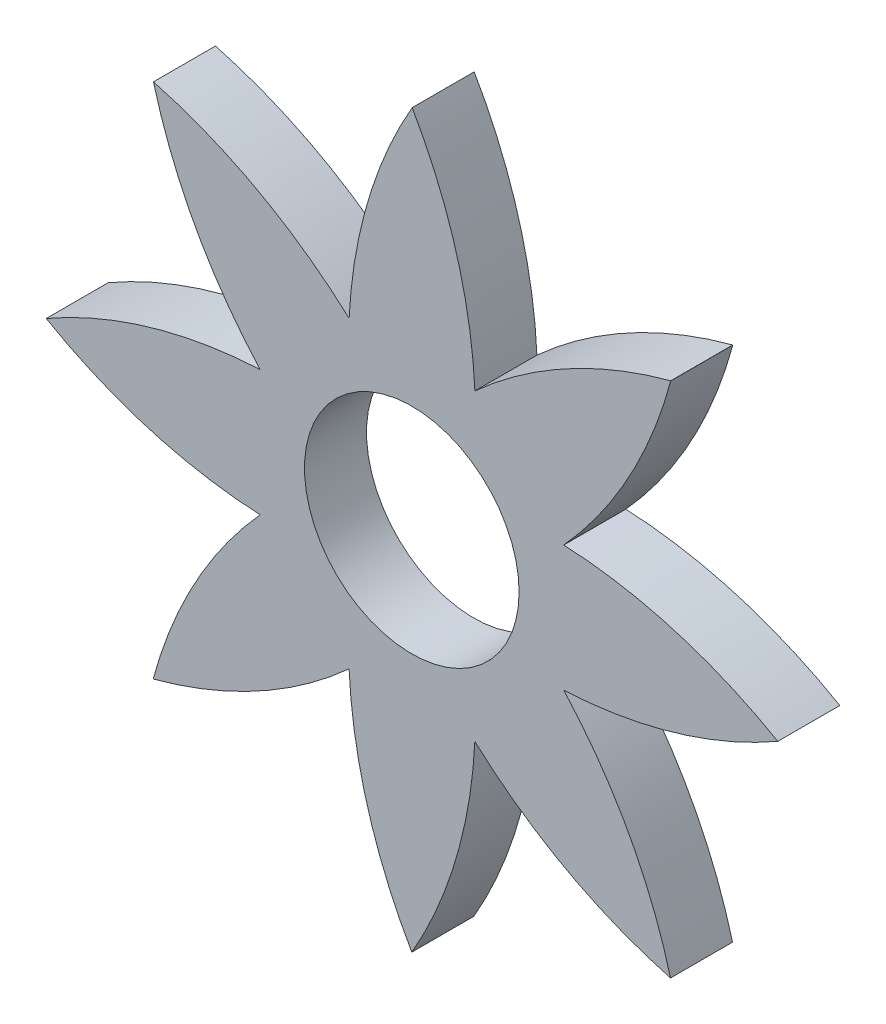
from build123d import *

# Parameters (mm, degrees)
SKETCH1_R           = 10.9855
BOSS_EXTRUDE2_DEPTH = 6.35


with BuildPart() as part:
    # Sketch1 → Boss-Extrude2 (new body)
    # profile 1 of 20: a face of its own
    with BuildSketch(Plane.XY):
        with BuildLine():
            ThreePointArc((0.725599052, 36.233324251), (0.387245814, 36.851641303), (0.039947491, 37.464978703))
            ThreePointArc((0.039947491, 37.464978703), (-0.326853313, 36.818932102), (-0.683720759, 36.167345833))
            add(Edge.make_bspline(
                [(0, 34.859646029), (-0.580282265, 35.475645915), (-0.683720759, 36.167345833)],
                knots=[0, 0, 0, 0.575593812, 0.575593812, 0.575593812], degree=2))
            add(Edge.make_bspline(
                [(0, 34.859646029), (0.639347765, 35.509933908), (0.725599052, 36.233324251)],
                knots=[0, 0, 0, 0.598690674, 0.598690674, 0.598690674], degree=2))
        make_face()
    # profile 2 of 20: a face of its own
    with BuildSketch(Plane.XY):
        with BuildLine():
            ThreePointArc((36.194267801, -0.706645191), (36.832280713, -0.358082254), (37.465, 0))
            ThreePointArc((37.465, 0), (36.81294861, 0.370149017), (36.155255982, 0.730179178))
            add(Edge.make_bspline(
                [(34.859646029, 0), (35.463556064, 0.626740684), (36.155255982, 0.730179178)],
                knots=[0, 0, 0, 0.575593812, 0.575593812, 0.575593812], degree=2))
            add(Edge.make_bspline(
                [(34.859646029, 0), (35.470877458, -0.620393904), (36.194267801, -0.706645191)],
                knots=[0, 0, 0, 0.598690674, 0.598690674, 0.598690674], degree=2))
        make_face()
    # profile 3 of 20: a face of its own
    with BuildSketch(Plane.XY):
        with BuildLine():
            ThreePointArc((26.509243661, 26.474255901), (26.505873515, 26.477630072), (26.502502939, 26.481003814))
            ThreePointArc((26.502502939, 26.481003814), (25.776279784, 26.280543343), (25.053256259, 26.068832561))
            add(Edge.make_bspline(
                [(24.649492097, 24.649492097), (24.637292617, 25.506584798), (25.053256259, 26.068832561)],
                knots=[0, 0, 0, 0.575593812, 0.575593812, 0.575593812], degree=2))
            add(Edge.make_bspline(
                [(24.649492097, 24.649492097), (25.54097737, 24.636803089), (26.113480457, 25.087328436)],
                knots=[0, 0, 0, 0.598690674, 0.598690674, 0.598690674], degree=2))
            ThreePointArc((26.113480457, 25.087328436), (26.316515102, 25.779321735), (26.509243661, 26.474255901))
        make_face()
    # profile 4 of 20: a face of its own
    with BuildSketch(Plane.XY):
        with BuildLine():
            add(Edge.make_bspline(
                [(0, 34.859646029), (-0.580282265, 35.475645915), (-0.683720759, 36.167345833)],
                knots=[0, 0, 0, 0.575593812, 0.575593812, 0.575593812], degree=2))
            ThreePointArc((-0.683720759, 36.167345833), (-4.698176398, 26.183432831), (-6.413626556, 15.560269287))
            ThreePointArc((-6.413626556, 15.560269287), (-15.157747682, 21.886999937), (-25.084018754, 26.124489473))
            add(Edge.make_bspline(
                [(-24.649492097, 24.649492097), (-24.633493407, 25.551986386), (-25.084018754, 26.124489473)],
                knots=[0, 0, 0, 0.598690674, 0.598690674, 0.598690674], degree=2))
            add(Edge.make_bspline(
                [(-24.649492097, 24.649492097), (-25.468227811, 24.637838574), (-26.017918136, 25.016883003)],
                knots=[0, 0, 0, 0.549834586, 0.549834586, 0.549834586], degree=2))
            ThreePointArc((-26.017918136, 25.016883003), (-21.799780938, 15.15429035), (-15.517921425, 6.459369056))
            ThreePointArc((-15.517921425, 6.459369056), (-26.177616138, 4.749185793), (-36.195385427, 0.724497401))
            add(Edge.make_bspline(
                [(-34.859646029, 0), (-35.477158461, 0.635345053), (-36.195385427, 0.724497401)],
                knots=[0, 0, 0, 0.5949425, 0.5949425, 0.5949425], degree=2))
            add(Edge.make_bspline(
                [(-34.859646029, 0), (-35.428878185, -0.585670531), (-36.083691779, -0.707217802)],
                knots=[0, 0, 0, 0.548426856, 0.548426856, 0.548426856], degree=2))
            ThreePointArc((-36.083691779, -0.707217802), (-26.119584212, -4.704836948), (-15.520321797, -6.413647853))
            ThreePointArc((-15.520321797, -6.413647853), (-21.840724444, -15.146588807), (-26.077138172, -25.059436334))
            add(Edge.make_bspline(
                [(-24.649492097, -24.649492097), (-25.512927659, -24.637202336), (-26.077138172, -25.059436334)],
                knots=[0, 0, 0, 0.579853458, 0.579853458, 0.579853458], degree=2))
            add(Edge.make_bspline(
                [(-24.649492097, -24.649492097), (-24.63767609, -25.47964335), (-25.027528903, -26.033194372)],
                knots=[0, 0, 0, 0.557500868, 0.557500868, 0.557500868], degree=2))
            ThreePointArc((-25.027528903, -26.033194372), (-15.137342243, -21.812807215), (-6.419421565, -15.517942722))
            ThreePointArc((-6.419421565, -15.517942722), (-4.718175503, -26.145370542), (-0.716229841, -36.136411085))
            add(Edge.make_bspline(
                [(0, -34.859646029), (-0.609185121, -35.451732776), (-0.716229841, -36.136411085)],
                knots=[0, 0, 0, 0.570446117, 0.570446117, 0.570446117], degree=2))
            add(Edge.make_bspline(
                [(0, -34.859646029), (0.610867678, -35.453368108), (0.716817321, -36.140193927)],
                knots=[0, 0, 0, 0.572021678, 0.572021678, 0.572021678], degree=2))
            ThreePointArc((0.716817321, -36.140193927), (4.736201708, -26.150494153), (6.453595343, -15.520343094))
            ThreePointArc((6.453595343, -15.520343094), (15.1860721, -21.84048292), (25.098362288, -26.076851759))
            add(Edge.make_bspline(
                [(24.649492097, -24.649492097), (24.647836941, -25.504348671), (25.098362288, -26.076851759)],
                knots=[0, 0, 0, 0.598690674, 0.598690674, 0.598690674], degree=2))
            add(Edge.make_bspline(
                [(24.649492097, -24.649492097), (25.517625765, -24.633975898), (26.079873527, -25.04993954)],
                knots=[0, 0, 0, 0.575593812, 0.575593812, 0.575593812], degree=2))
            ThreePointArc((26.079873527, -25.04993954), (21.858504505, -15.147541422), (15.557890213, -6.419442862))
            ThreePointArc((15.557890213, -6.419442862), (26.195111374, -4.715486799), (36.194267801, -0.706645191))
            add(Edge.make_bspline(
                [(34.859646029, 0), (35.470877458, -0.620393904), (36.194267801, -0.706645191)],
                knots=[0, 0, 0, 0.598690674, 0.598690674, 0.598690674], degree=2))
            add(Edge.make_bspline(
                [(34.859646029, 0), (35.463556064, 0.626740684), (36.155255982, 0.730179178)],
                knots=[0, 0, 0, 0.575593812, 0.575593812, 0.575593812], degree=2))
            ThreePointArc((36.155255982, 0.730179178), (26.176830118, 4.739965224), (15.560290584, 6.453574046))
            ThreePointArc((15.560290584, 6.453574046), (21.877596655, 15.181046552), (26.113480457, 25.087328436))
            add(Edge.make_bspline(
                [(24.649492097, 24.649492097), (25.54097737, 24.636803089), (26.113480457, 25.087328436)],
                knots=[0, 0, 0, 0.598690674, 0.598690674, 0.598690674], degree=2))
            add(Edge.make_bspline(
                [(24.649492097, 24.649492097), (24.637292617, 25.506584798), (25.053256259, 26.068832561)],
                knots=[0, 0, 0, 0.575593812, 0.575593812, 0.575593812], degree=2))
            ThreePointArc((25.053256259, 26.068832561), (15.170837028, 21.849074361), (6.459390353, 15.557868916))
            ThreePointArc((6.459390353, 15.557868916), (4.749511856, 26.216464723), (0.725599052, 36.233324251))
            add(Edge.make_bspline(
                [(0, 34.859646029), (0.639347765, 35.509933908), (0.725599052, 36.233324251)],
                knots=[0, 0, 0, 0.598690674, 0.598690674, 0.598690674], degree=2))
        make_face()
        Circle(SKETCH1_R, mode=Mode.SUBTRACT)
        with BuildLine():
            Line((-3.795617071, 13.62294616), (-3.81362909, 13.698047122))
            Line((-3.81362909, 13.698047122), (-3.08337909, 13.873587987))
            add(Edge.make_bspline(
                [(-3.08337909, 13.873587987), (-3.063280633, 13.878028491), (-3.02420509, 13.886661747), (-2.966454885, 13.894806079), (-2.911578445, 13.899080793), (-2.859482036, 13.898469333), (-2.810121771, 13.893675746), (-2.763416983, 13.884636566), (-2.719583215, 13.870898125), (-2.678855747, 13.85272974), (-2.641201816, 13.831167862), (-2.607142064, 13.805893963), (-2.576419132, 13.777763581), (-2.549256435, 13.746382465), (-2.526075218, 13.711580695), (-2.506123679, 13.673884941), (-2.489821798, 13.633013377), (-2.481987762, 13.604309774), (-2.477992071, 13.589669718)],
                knots=[0, 0, 0, 0, 1.308278959, 2.543563829, 3.704781719, 4.804793484, 5.851628623, 6.854072724, 7.824043264, 8.765453216, 9.684359676, 10.577272055, 11.456459043, 12.32809019, 13.209203526, 14.109330391, 15.035678246, 16, 16, 16, 16], degree=3))
            add(Edge.make_bspline(
                [(-2.477992071, 13.589669718), (-2.474861204, 13.574859517), (-2.468788119, 13.546131492), (-2.464547149, 13.503273938), (-2.464344332, 13.462239238), (-2.468859263, 13.422848508), (-2.478194668, 13.385411104), (-2.491380544, 13.349580907), (-2.508950288, 13.315396148), (-2.524298545, 13.294769239), (-2.532028129, 13.284381256)],
                knots=[0, 0, 0, 0, 1.129543526, 2.191027313, 3.209177, 4.18839317, 5.14297985, 6.082970429, 7.034558733, 8, 8, 8, 8], degree=3))
            add(Edge.make_bspline(
                [(-2.532028129, 13.284381256), (-2.543471491, 13.270511002), (-2.566280701, 13.242864448), (-2.605213752, 13.205499806), (-2.647432132, 13.171681922), (-2.692793214, 13.140835491), (-2.741760026, 13.114100718), (-2.794052866, 13.09081057), (-2.849670303, 13.070855287), (-2.888417757, 13.060623674), (-2.908143513, 13.05541491)],
                knots=[0, 0, 0, 0, 0.960873234, 1.915237659, 2.878941793, 3.850891168, 4.844533133, 5.857827372, 6.909451557, 8, 8, 8, 8], degree=3))
            Line((-2.908143513, 13.05541491), (-3.172523321, 12.99191491))
            Line((-3.172523321, 12.99191491), (-3.051018513, 12.486051929))
            add(Edge.make_bspline(
                [(-3.051018513, 12.486051929), (-3.049068238, 12.479267671), (-3.045430326, 12.466612769), (-3.037533134, 12.44972784), (-3.027559231, 12.436247168), (-3.018842108, 12.430486345), (-3.014689186, 12.427741833)],
                knots=[0, 0, 0, 0, 1.198237221, 2.235111522, 3.159189951, 4, 4, 4, 4], degree=3))
            add(Edge.make_bspline(
                [(-3.014689186, 12.427741833), (-3.008877629, 12.425103322), (-2.997124599, 12.419767316), (-2.977222805, 12.417168505), (-2.955883399, 12.417314179), (-2.941389691, 12.420349387), (-2.933787744, 12.421941352)],
                knots=[0, 0, 0, 0, 0.919897154, 1.860358431, 2.877758515, 4, 4, 4, 4], degree=3))
            Line((-2.933787744, 12.421941352), (-2.765573802, 12.462239429))
            Line((-2.765573802, 12.462239429), (-2.747561782, 12.387138468))
            Line((-2.747561782, 12.387138468), (-3.457662744, 12.216482218))
            Line((-3.457662744, 12.216482218), (-3.475674763, 12.291583179))
            Line((-3.475674763, 12.291583179), (-3.327609859, 12.327301929))
            add(Edge.make_bspline(
                [(-3.327609859, 12.327301929), (-3.320742272, 12.329177045), (-3.307980743, 12.332661433), (-3.290711296, 12.339912793), (-3.277091502, 12.349034053), (-3.266805426, 12.359760019), (-3.260045446, 12.371795555), (-3.256285381, 12.384841462), (-3.255248432, 12.398735691), (-3.257069685, 12.408019553), (-3.25800409, 12.412782699)],
                knots=[0, 0, 0, 0, 1.364353483, 2.535276777, 3.574407053, 4.485463177, 5.359186792, 6.192768775, 7.072788405, 8, 8, 8, 8], degree=3))
            Line((-3.25800409, 12.412782699), (-3.541922359, 13.593943756))
            add(Edge.make_bspline(
                [(-3.541922359, 13.593943756), (-3.543873983, 13.600972858), (-3.547512449, 13.614077411), (-3.556964594, 13.631129327), (-3.56871806, 13.644559342), (-3.583955001, 13.653973112), (-3.603196538, 13.658664662), (-3.62666996, 13.659619688), (-3.655112787, 13.656034702), (-3.675472689, 13.651620029), (-3.68662909, 13.649200968)],
                knots=[0, 0, 0, 0, 0.973930744, 1.815726659, 2.587553381, 3.34013317, 4.173169956, 5.210261056, 6.471336184, 8, 8, 8, 8], degree=3))
            Line((-3.68662909, 13.649200968), (-3.795617071, 13.62294616))
        make_face(mode=Mode.SUBTRACT)
        with BuildLine():
            add(Edge.make_bspline(
                [(-1.182401987, 12.725834003), (-1.175700205, 12.727192497), (-1.161831218, 12.730003829), (-1.141910222, 12.739811508), (-1.121773607, 12.752894134), (-1.109670871, 12.764386955), (-1.103332276, 12.770406118)],
                knots=[0, 0, 0, 0, 0.886132513, 1.8338047, 2.865493209, 4, 4, 4, 4], degree=3))
            Line((-1.103332276, 12.770406118), (-1.058454872, 12.71850708))
            add(Edge.make_bspline(
                [(-1.058454872, 12.71850708), (-1.063839877, 12.711497123), (-1.074314691, 12.697861484), (-1.091499828, 12.679375614), (-1.10966705, 12.663411732), (-1.12858069, 12.649556359), (-1.14853909, 12.638137176), (-1.169417565, 12.629410664), (-1.190913321, 12.622369491), (-1.205763198, 12.619913623), (-1.213236122, 12.618677753)],
                knots=[0, 0, 0, 0, 1.119371399, 2.177380912, 3.191195148, 4.178771287, 5.142932739, 6.095912367, 7.041803292, 8, 8, 8, 8], degree=3))
            add(Edge.make_bspline(
                [(-1.213236122, 12.618677753), (-1.224424304, 12.617435023), (-1.246110225, 12.615026255), (-1.278052476, 12.618583496), (-1.308188178, 12.625871284), (-1.336466849, 12.639579562), (-1.363387406, 12.659479136), (-1.389101056, 12.686690918), (-1.413967483, 12.721220095), (-1.429015488, 12.747357215), (-1.437012564, 12.761247464)],
                knots=[0, 0, 0, 0, 0.941171019, 1.824260678, 2.679066336, 3.53024368, 4.439979007, 5.471975633, 6.656512709, 8, 8, 8, 8], degree=3))
            add(Edge.make_bspline(
                [(-1.437012564, 12.761247464), (-1.450335285, 12.743277263), (-1.475347109, 12.709540348), (-1.513760351, 12.664394107), (-1.550914404, 12.628540604), (-1.58715988, 12.600102437), (-1.6252773, 12.579160521), (-1.666400892, 12.562628588), (-1.711754287, 12.549764789), (-1.743761435, 12.544478644), (-1.760313045, 12.54174506)],
                knots=[0, 0, 0, 0, 1.326041294, 2.489484848, 3.50924602, 4.382839554, 5.211974146, 6.077952149, 7.006066166, 8, 8, 8, 8], degree=3))
            add(Edge.make_bspline(
                [(-1.760313045, 12.54174506), (-1.772205528, 12.540288714), (-1.795327985, 12.537457153), (-1.829287602, 12.535533877), (-1.861318941, 12.536176937), (-1.891561687, 12.538790546), (-1.919761089, 12.543937748), (-1.946180615, 12.551288787), (-1.970528327, 12.5610325), (-1.993034857, 12.572904367), (-2.013019517, 12.587109726), (-2.031303157, 12.602246512), (-2.046945249, 12.619372636), (-2.060728081, 12.63755821), (-2.072234312, 12.657303539), (-2.080914044, 12.678667607), (-2.088248093, 12.701254642), (-2.090841118, 12.717135954), (-2.092161603, 12.725223426)],
                knots=[0, 0, 0, 0, 1.346744241, 2.618463861, 3.819906157, 4.94576686, 6.027337834, 7.037776571, 8.023497165, 8.970344878, 9.890697179, 10.77544958, 11.633543278, 12.491560711, 13.337287196, 14.193548664, 15.080074413, 16, 16, 16, 16], degree=3))
            add(Edge.make_bspline(
                [(-2.092161603, 12.725223426), (-2.093392415, 12.737527424), (-2.0958261, 12.761856133), (-2.092145886, 12.798505595), (-2.082852769, 12.834173759), (-2.068012327, 12.869094627), (-2.047186627, 12.902815164), (-2.020859368, 12.93571451), (-1.988908249, 12.967819429), (-1.951306891, 12.998583272), (-1.909186621, 13.02848638), (-1.862747296, 13.05670239), (-1.812433371, 13.083548441), (-1.758593343, 13.109291891), (-1.700421512, 13.13265956), (-1.638615331, 13.154872994), (-1.572849878, 13.175743043), (-1.527429287, 13.187915012), (-1.504176026, 13.194146503)],
                knots=[0, 0, 0, 0, 0.727566612, 1.438618213, 2.157499157, 2.894113374, 3.666883545, 4.486779841, 5.373479428, 6.332198063, 7.347715538, 8.416850738, 9.533531896, 10.709027527, 11.9334964, 13.22782368, 14.58077277, 16, 16, 16, 16], degree=3))
            Line((-1.504176026, 13.194146503), (-1.524630353, 13.339158522))
            add(Edge.make_bspline(
                [(-1.524630353, 13.339158522), (-1.527101764, 13.351654605), (-1.531949239, 13.376164676), (-1.549348383, 13.409884227), (-1.574024877, 13.439220612), (-1.605296823, 13.464094309), (-1.641592883, 13.483674859), (-1.682304255, 13.495617192), (-1.726206474, 13.500417909), (-1.756152013, 13.497353322), (-1.771608718, 13.495771503)],
                knots=[0, 0, 0, 0, 0.935745759, 1.835390825, 2.762820561, 3.745182923, 4.766022022, 5.784789303, 6.856595714, 8, 8, 8, 8], degree=3))
            add(Edge.make_bspline(
                [(-1.771608718, 13.495771503), (-1.78584201, 13.49339368), (-1.813489976, 13.488774793), (-1.852448049, 13.475903285), (-1.888222469, 13.459759619), (-1.909087041, 13.44502659), (-1.919368334, 13.437766695)],
                knots=[0, 0, 0, 0, 1.077771675, 2.093556071, 3.0605746, 4, 4, 4, 4], degree=3))
            add(Edge.make_bspline(
                [(-1.919368334, 13.437766695), (-1.925656831, 13.432345518), (-1.937000982, 13.422565973), (-1.950058425, 13.406865143), (-1.957922049, 13.391532957), (-1.95786206, 13.381354611), (-1.95783468, 13.376709003)],
                knots=[0, 0, 0, 0, 1.325403827, 2.390965548, 3.265603238, 4, 4, 4, 4], degree=3))
            add(Edge.make_bspline(
                [(-1.95783468, 13.376709003), (-1.957049011, 13.373804215), (-1.955232533, 13.367088298), (-1.948431547, 13.356938166), (-1.938603163, 13.345220973), (-1.930721562, 13.336974369), (-1.926389968, 13.332442176)],
                knots=[0, 0, 0, 0, 0.653570473, 1.511065714, 2.632124181, 4, 4, 4, 4], degree=3))
            add(Edge.make_bspline(
                [(-1.926389968, 13.332442176), (-1.921057614, 13.326553451), (-1.911002944, 13.31544969), (-1.898936669, 13.298013939), (-1.890503967, 13.281037319), (-1.887924901, 13.269517674), (-1.886702468, 13.26405756)],
                knots=[0, 0, 0, 0, 1.187443784, 2.239040062, 3.165335219, 4, 4, 4, 4], degree=3))
            add(Edge.make_bspline(
                [(-1.886702468, 13.26405756), (-1.886002015, 13.256632651), (-1.884653879, 13.24234219), (-1.887477835, 13.221178507), (-1.894635075, 13.201795599), (-1.905427437, 13.184281503), (-1.919391294, 13.169013238), (-1.937171141, 13.157823138), (-1.957131362, 13.148818514), (-1.971884858, 13.146297856), (-1.97951016, 13.14499506)],
                knots=[0, 0, 0, 0, 1.052922811, 2.026523293, 2.992423825, 3.955744031, 4.923682443, 5.890334274, 6.909625288, 8, 8, 8, 8], degree=3))
            add(Edge.make_bspline(
                [(-1.97951016, 13.14499506), (-1.987754926, 13.144245598), (-2.003806616, 13.142786474), (-2.027607315, 13.146401299), (-2.049913109, 13.15433177), (-2.070113546, 13.167123255), (-2.087913831, 13.183318033), (-2.101392363, 13.203463847), (-2.11166384, 13.226229565), (-2.114701693, 13.242888814), (-2.116279391, 13.251540733)],
                knots=[0, 0, 0, 0, 1.021909861, 1.989550797, 2.954151285, 3.933211171, 4.931781117, 5.910435477, 6.914792445, 8, 8, 8, 8], degree=3))
            add(Edge.make_bspline(
                [(-2.116279391, 13.251540733), (-2.117188855, 13.259982404), (-2.118997747, 13.276772586), (-2.116367511, 13.302261577), (-2.111048085, 13.327662051), (-2.101615051, 13.352959866), (-2.088660148, 13.378132696), (-2.071957613, 13.403128415), (-2.051999028, 13.42838994), (-2.028350535, 13.45306304), (-2.001776215, 13.476779997), (-1.972178254, 13.498277912), (-1.940023968, 13.517419033), (-1.905547321, 13.534676355), (-1.868236447, 13.548923689), (-1.828448571, 13.561091729), (-1.786056263, 13.571285048), (-1.756688506, 13.575861965), (-1.741690449, 13.578199387)],
                knots=[0, 0, 0, 0, 0.744397518, 1.480580146, 2.240299156, 3.021362887, 3.845496662, 4.723777777, 5.659791585, 6.672153239, 7.724053864, 8.786852167, 9.882204357, 11.010341411, 12.171509201, 13.388201871, 14.66615972, 16, 16, 16, 16], degree=3))
            add(Edge.make_bspline(
                [(-1.741690449, 13.578199387), (-1.727866144, 13.579881794), (-1.70098894, 13.583152729), (-1.661528247, 13.585344161), (-1.624281222, 13.584828263), (-1.589143162, 13.5815189), (-1.55626303, 13.575424101), (-1.525514491, 13.567001167), (-1.4970771, 13.555635129), (-1.479562954, 13.54601706), (-1.470899584, 13.541259483)],
                knots=[0, 0, 0, 0, 1.199603818, 2.332268831, 3.402041499, 4.406172966, 5.369156767, 6.279621771, 7.149015168, 8, 8, 8, 8], degree=3))
            add(Edge.make_bspline(
                [(-1.470899584, 13.541259483), (-1.462840119, 13.536035797), (-1.447077056, 13.525819075), (-1.425994693, 13.507963948), (-1.407568173, 13.488881667), (-1.391395855, 13.468787242), (-1.37855075, 13.446753304), (-1.368242345, 13.423488662), (-1.359915037, 13.398928235), (-1.357188215, 13.381752763), (-1.355805834, 13.373045541)],
                knots=[0, 0, 0, 0, 1.091613823, 2.135027596, 3.133757521, 4.106386558, 5.06128887, 6.025060543, 6.998791086, 8, 8, 8, 8], degree=3))
            Line((-1.355805834, 13.373045541), (-1.282231314, 12.850391695))
            add(Edge.make_bspline(
                [(-1.282231314, 12.850391695), (-1.280401141, 12.839660245), (-1.27698338, 12.819619778), (-1.269175539, 12.792174831), (-1.259245, 12.769307746), (-1.249706698, 12.757328653), (-1.24529141, 12.751783522)],
                knots=[0, 0, 0, 0, 1.223175693, 2.284221666, 3.205764928, 4, 4, 4, 4], degree=3))
            add(Edge.make_bspline(
                [(-1.24529141, 12.751783522), (-1.240804999, 12.747171454), (-1.23220031, 12.738325761), (-1.216566367, 12.72925578), (-1.199650457, 12.724502349), (-1.188226085, 12.725384358), (-1.182401987, 12.725834003)],
                knots=[0, 0, 0, 0, 1.082876227, 2.076897003, 3.019609929, 4, 4, 4, 4], degree=3))
        make_face(mode=Mode.SUBTRACT)
        with BuildLine():
            Line((-0.974535775, 13.626991975), (-0.632917986, 13.654162648))
            Line((-0.632917986, 13.654162648), (-0.614905967, 13.014278033))
            add(Edge.make_bspline(
                [(-0.614905967, 13.014278033), (-0.61457553, 13.00479863), (-0.613929981, 12.986279511), (-0.610004901, 12.959495292), (-0.605079201, 12.934172579), (-0.597603423, 12.910760584), (-0.588861634, 12.888892625), (-0.578135622, 12.868901028), (-0.565452178, 12.850747248), (-0.551247089, 12.834228447), (-0.535210801, 12.81999802), (-0.518480312, 12.807327203), (-0.500508024, 12.796871028), (-0.481613482, 12.788293641), (-0.461639622, 12.781833075), (-0.440635528, 12.777657409), (-0.418671735, 12.775055698), (-0.403653707, 12.77517598), (-0.39601414, 12.775237167)],
                knots=[0, 0, 0, 0, 1.242372697, 2.427119759, 3.54422505, 4.620110019, 5.643178487, 6.627961256, 7.586370931, 8.541339603, 9.47634813, 10.391447278, 11.28827992, 12.195763686, 13.10696546, 14.033082145, 14.999442496, 16, 16, 16, 16], degree=3))
            add(Edge.make_bspline(
                [(-0.39601414, 12.775237167), (-0.386522742, 12.775707999), (-0.367909989, 12.776631307), (-0.340721827, 12.782143703), (-0.314554444, 12.789995867), (-0.289565719, 12.801009898), (-0.265855075, 12.814907361), (-0.243353312, 12.831602392), (-0.221933194, 12.851204536), (-0.202005288, 12.873694959), (-0.183853715, 12.898232474), (-0.167848683, 12.92419934), (-0.154594921, 12.951728643), (-0.143983912, 12.980564182), (-0.135984114, 13.010932037), (-0.130509152, 13.042586955), (-0.127763297, 13.075692629), (-0.127900924, 13.098126387), (-0.127970871, 13.109528033)],
                knots=[0, 0, 0, 0, 0.954604452, 1.871991569, 2.781810114, 3.698454616, 4.611319597, 5.540733326, 6.511552795, 7.526479521, 8.558247343, 9.578168285, 10.589889916, 11.626166504, 12.663958486, 13.744288269, 14.853565923, 16, 16, 16, 16], degree=3))
            Line((-0.127970871, 13.109528033), (-0.13804539, 13.470989571))
            add(Edge.make_bspline(
                [(-0.13804539, 13.470989571), (-0.138592232, 13.478787787), (-0.139647601, 13.493837828), (-0.147228428, 13.514817543), (-0.159238683, 13.53274164), (-0.175903512, 13.548314519), (-0.199507196, 13.560009886), (-0.230448375, 13.567651822), (-0.26904965, 13.572784066), (-0.297486985, 13.573092962), (-0.312975679, 13.573261206)],
                knots=[0, 0, 0, 0, 0.81512422, 1.573135922, 2.302780673, 3.056515088, 3.933065147, 5.026015339, 6.380187995, 8, 8, 8, 8], degree=3))
            Line((-0.312975679, 13.573261206), (-0.315112698, 13.645309283))
            Line((-0.315112698, 13.645309283), (0.023146917, 13.672479956))
            Line((0.023146917, 13.672479956), (0.045432975, 12.87995111))
            add(Edge.make_bspline(
                [(0.045432975, 12.87995111), (0.046033224, 12.871354463), (0.047173185, 12.855028178), (0.053747318, 12.832223356), (0.063795185, 12.812414485), (0.078177146, 12.796268602), (0.09599921, 12.783843192), (0.116854355, 12.77534015), (0.140548793, 12.770361375), (0.157244489, 12.770155499), (0.166021917, 12.770047263)],
                knots=[0, 0, 0, 0, 1.113427236, 2.114560516, 3.051892431, 3.966905952, 4.884667978, 5.841714122, 6.865324448, 8, 8, 8, 8], degree=3))
            Line((0.166021917, 12.770047263), (0.226774321, 12.771573706))
            Line((0.226774321, 12.771573706), (0.228606052, 12.702578513))
            Line((0.228606052, 12.702578513), (-0.095610294, 12.68548236))
            Line((-0.095610294, 12.68548236), (-0.121254525, 12.875371783))
            add(Edge.make_bspline(
                [(-0.121254525, 12.875371783), (-0.13505138, 12.858769885), (-0.161684386, 12.826722115), (-0.204263575, 12.783821037), (-0.247149065, 12.747255177), (-0.290116733, 12.716613744), (-0.33388078, 12.692947047), (-0.377694712, 12.675164882), (-0.422258106, 12.664095807), (-0.452231836, 12.661864341), (-0.467146352, 12.660753994)],
                knots=[0, 0, 0, 0, 1.233029143, 2.38019982, 3.448623964, 4.450427645, 5.389714078, 6.284855986, 7.146567902, 8, 8, 8, 8], degree=3))
            add(Edge.make_bspline(
                [(-0.467146352, 12.660753994), (-0.477836443, 12.660791669), (-0.498857789, 12.660865754), (-0.529874909, 12.663822037), (-0.559608786, 12.670020712), (-0.588154622, 12.678873975), (-0.615461013, 12.690549816), (-0.641483174, 12.704903279), (-0.666179715, 12.722190847), (-0.681374443, 12.735504629), (-0.689091063, 12.742266013)],
                knots=[0, 0, 0, 0, 1.056408574, 2.077356386, 3.073624467, 4.053558758, 5.027017927, 6.004056669, 6.986363061, 8, 8, 8, 8], degree=3))
            add(Edge.make_bspline(
                [(-0.689091063, 12.742266013), (-0.696568833, 12.749683), (-0.711840874, 12.764830903), (-0.730477549, 12.792284977), (-0.747278147, 12.8229003), (-0.76040298, 12.857850796), (-0.771525981, 12.896285445), (-0.779121909, 12.938765424), (-0.784777063, 12.98483244), (-0.786098979, 13.016905908), (-0.786783371, 13.033511206)],
                knots=[0, 0, 0, 0, 0.800107989, 1.634081124, 2.514545595, 3.454010004, 4.469225545, 5.557156346, 6.735274066, 8, 8, 8, 8], degree=3))
            Line((-0.786783371, 13.033511206), (-0.798689621, 13.452672263))
            add(Edge.make_bspline(
                [(-0.798689621, 13.452672263), (-0.79935805, 13.461414069), (-0.800646326, 13.478262333), (-0.809964171, 13.501614885), (-0.824605354, 13.521744248), (-0.838151523, 13.531180342), (-0.845093467, 13.536016013)],
                knots=[0, 0, 0, 0, 1.050326569, 2.024316187, 2.987530309, 4, 4, 4, 4], degree=3))
            add(Edge.make_bspline(
                [(-0.845093467, 13.536016013), (-0.851618015, 13.539125755), (-0.866731901, 13.546329362), (-0.895167688, 13.551500291), (-0.931092629, 13.554718178), (-0.957729897, 13.554863739), (-0.972398756, 13.554943898)],
                knots=[0, 0, 0, 0, 0.665338575, 1.541233612, 2.645983654, 4, 4, 4, 4], degree=3))
            Line((-0.972398756, 13.554943898), (-0.974535775, 13.626991975))
        make_face(mode=Mode.SUBTRACT)
        with BuildLine():
            add(Edge.make_bspline(
                [(3.862504462, 12.177781626), (3.869193899, 12.176376431), (3.882984451, 12.173479563), (3.905036332, 12.174645208), (3.928521256, 12.178814545), (3.944088115, 12.184543623), (3.95225927, 12.187550857)],
                knots=[0, 0, 0, 0, 0.890361449, 1.835517209, 2.863847668, 4, 4, 4, 4], degree=3))
            Line((3.95225927, 12.187550857), (3.973018885, 12.122219126))
            add(Edge.make_bspline(
                [(3.973018885, 12.122219126), (3.9653525, 12.117914001), (3.950411682, 12.109523856), (3.927320377, 12.099417179), (3.904479207, 12.091609193), (3.881598856, 12.086865997), (3.858927392, 12.083808988), (3.836310609, 12.084116471), (3.813814967, 12.085885995), (3.799274097, 12.089548494), (3.791982827, 12.091384991)],
                knots=[0, 0, 0, 0, 1.116592015, 2.176097269, 3.198336289, 4.177297619, 5.141199094, 6.098049765, 7.046299751, 8, 8, 8, 8], degree=3))
            add(Edge.make_bspline(
                [(3.791982827, 12.091384991), (3.781257094, 12.094689555), (3.760458672, 12.101097481), (3.732235334, 12.11647448), (3.707817868, 12.135416531), (3.687181655, 12.158936187), (3.67039261, 12.187775856), (3.658106079, 12.222979759), (3.647733419, 12.264110536), (3.644447594, 12.294029475), (3.64269677, 12.30997153)],
                knots=[0, 0, 0, 0, 0.941676528, 1.826018223, 2.68529241, 3.528048825, 4.440826365, 5.472331635, 6.653153274, 8, 8, 8, 8], degree=3))
            add(Edge.make_bspline(
                [(3.64269677, 12.30997153), (3.632861638, 12.304108885), (3.613754495, 12.292719269), (3.58533793, 12.27715788), (3.558176897, 12.263358519), (3.532286993, 12.251493153), (3.507702019, 12.241253539), (3.484397971, 12.232957152), (3.462200142, 12.226916726), (3.434301916, 12.22051053), (3.398642835, 12.217210909), (3.354447216, 12.218338116), (3.307744108, 12.224037607), (3.276384744, 12.231782119), (3.260170327, 12.235786433)],
                knots=[0, 0, 0, 0, 1.021055362, 1.983649041, 2.888737385, 3.737471152, 4.522849022, 5.263372172, 5.941543539, 6.573508262, 7.814287823, 9.121431914, 10.51163108, 12, 12, 12, 12], degree=3))
            add(Edge.make_bspline(
                [(3.260170327, 12.235786433), (3.24863005, 12.239114025), (3.226261383, 12.245563939), (3.194368846, 12.257126124), (3.165331768, 12.270284339), (3.138808999, 12.284637118), (3.115001982, 12.300480407), (3.093783521, 12.317594559), (3.075223544, 12.336088636), (3.059381535, 12.355874629), (3.046272362, 12.376615212), (3.035779681, 12.397917441), (3.027727244, 12.41957692), (3.02260792, 12.441746157), (3.019680548, 12.464259995), (3.019897325, 12.487298987), (3.022124968, 12.510890149), (3.025919423, 12.526456009), (3.027845808, 12.534358549)],
                knots=[0, 0, 0, 0, 1.353957022, 2.624392203, 3.820862555, 4.945353497, 6.02095723, 7.040577231, 8.014161449, 8.969247621, 9.892371703, 10.774959791, 11.642503516, 12.49133211, 13.335261107, 14.19579611, 15.084034247, 16, 16, 16, 16], degree=3))
            add(Edge.make_bspline(
                [(3.027845808, 12.534358549), (3.03151071, 12.546125854), (3.038773233, 12.569444435), (3.056769264, 12.601366962), (3.079004382, 12.630624044), (3.106395272, 12.656568752), (3.138751871, 12.679416928), (3.175913749, 12.699016401), (3.217709808, 12.716377751), (3.264438383, 12.72958627), (3.314802411, 12.740533012), (3.368455686, 12.748445743), (3.425041574, 12.753114142), (3.484546056, 12.755455725), (3.546979898, 12.753774877), (3.612396476, 12.750411527), (3.680805914, 12.7431568), (3.727282041, 12.736506017), (3.751074174, 12.733101337)],
                knots=[0, 0, 0, 0, 0.726764621, 1.440186983, 2.152467158, 2.892797973, 3.660626159, 4.486886228, 5.371645632, 6.331011323, 7.352808767, 8.417088902, 9.53412389, 10.707915775, 11.935328122, 13.224682637, 14.579255103, 16, 16, 16, 16], degree=3))
            Line((3.751074174, 12.733101337), (3.78954052, 12.874144607))
            add(Edge.make_bspline(
                [(3.78954052, 12.874144607), (3.792150713, 12.88649738), (3.797319875, 12.91096051), (3.794928761, 12.948724428), (3.783635163, 12.985438807), (3.764649406, 13.020482528), (3.738997891, 13.052813714), (3.706405112, 13.079815699), (3.66797881, 13.101245563), (3.639437327, 13.110324476), (3.624684751, 13.115017203)],
                knots=[0, 0, 0, 0, 0.929823295, 1.841399135, 2.759898747, 3.749146243, 4.771048879, 5.790845868, 6.858128133, 8, 8, 8, 8], degree=3))
            add(Edge.make_bspline(
                [(3.624684751, 13.115017203), (3.610708014, 13.118453678), (3.583514916, 13.125139673), (3.542637968, 13.128547362), (3.503441776, 13.127524217), (3.478503849, 13.122209947), (3.466240039, 13.11959653)],
                knots=[0, 0, 0, 0, 1.076303012, 2.094051879, 3.062705401, 4, 4, 4, 4], degree=3))
            add(Edge.make_bspline(
                [(3.466240039, 13.11959653), (3.458392468, 13.11722103), (3.444205774, 13.112926647), (3.426354498, 13.103443449), (3.413245952, 13.092516605), (3.409186112, 13.083252755), (3.407319366, 13.078993164)],
                knots=[0, 0, 0, 0, 1.319703955, 2.385736311, 3.257748915, 4, 4, 4, 4], degree=3))
            add(Edge.make_bspline(
                [(3.407319366, 13.078993164), (3.406850786, 13.076040001), (3.405763899, 13.069190032), (3.408451549, 13.057360026), (3.412255101, 13.04264289), (3.416348639, 13.032045525), (3.418615039, 13.02617826)],
                knots=[0, 0, 0, 0, 0.651359354, 1.510851771, 2.621875283, 4, 4, 4, 4], degree=3))
            add(Edge.make_bspline(
                [(3.418615039, 13.02617826), (3.42126486, 13.018600096), (3.426211282, 13.004453936), (3.430142259, 12.983630604), (3.431743667, 12.964774117), (3.429255216, 12.953193178), (3.428078981, 12.947719126)],
                knots=[0, 0, 0, 0, 1.198509378, 2.237257646, 3.166791019, 4, 4, 4, 4], degree=3))
            add(Edge.make_bspline(
                [(3.428078981, 12.947719126), (3.425787871, 12.940693706), (3.421370694, 12.927148953), (3.410685375, 12.90889057), (3.396835125, 12.893647666), (3.379757068, 12.882139393), (3.360888091, 12.87367873), (3.340246365, 12.869836949), (3.318440578, 12.86967493), (3.303989409, 12.873020988), (3.296499654, 12.874755183)],
                knots=[0, 0, 0, 0, 1.047600026, 2.019734696, 2.981707776, 3.948342499, 4.92616002, 5.898832226, 6.911006405, 8, 8, 8, 8], degree=3))
            add(Edge.make_bspline(
                [(3.296499654, 12.874755183), (3.288637105, 12.87729988), (3.273282709, 12.882269295), (3.25275558, 12.89477039), (3.235575286, 12.911068668), (3.221984092, 12.930611807), (3.211919028, 12.952487664), (3.207638091, 12.976400212), (3.206904078, 13.001425032), (3.210833012, 13.017981433), (3.212850616, 13.026483549)],
                knots=[0, 0, 0, 0, 1.020604705, 1.993089884, 2.946862957, 3.932726567, 4.925571676, 5.901723702, 6.922483975, 8, 8, 8, 8], degree=3))
            add(Edge.make_bspline(
                [(3.212850616, 13.026483549), (3.215356096, 13.034515849), (3.220359691, 13.050556836), (3.232277258, 13.073043139), (3.247492806, 13.093982277), (3.265810544, 13.113651947), (3.287878433, 13.131259164), (3.312828686, 13.147939079), (3.341143796, 13.163071168), (3.372528646, 13.17636568), (3.406143791, 13.187671582), (3.441698293, 13.19597932), (3.478723863, 13.200722251), (3.517210198, 13.202547284), (3.557116224, 13.201268826), (3.598414301, 13.196893033), (3.641193896, 13.18962846), (3.66981233, 13.182289297), (3.684521289, 13.178517203)],
                knots=[0, 0, 0, 0, 0.740562894, 1.478948617, 2.230945287, 3.018036896, 3.84058558, 4.714015759, 5.661366307, 6.666278431, 7.716049204, 8.784630143, 9.879700851, 11.002501094, 12.178390319, 13.39611569, 14.661686802, 16, 16, 16, 16], degree=3))
            add(Edge.make_bspline(
                [(3.684521289, 13.178517203), (3.697891639, 13.174575686), (3.723830036, 13.166929169), (3.760915766, 13.153686841), (3.794676844, 13.138219102), (3.825602727, 13.121565273), (3.853499382, 13.103190206), (3.878492695, 13.083424258), (3.899978012, 13.061575615), (3.91230423, 13.045833921), (3.918372251, 13.03808451)],
                knots=[0, 0, 0, 0, 1.203091481, 2.333989982, 3.395311789, 4.405459582, 5.362867815, 6.2750905, 7.150851693, 8, 8, 8, 8], degree=3))
            add(Edge.make_bspline(
                [(3.918372251, 13.03808451), (3.923596603, 13.030129088), (3.933794538, 13.014600106), (3.946541899, 12.990277414), (3.955969268, 12.965559062), (3.962515122, 12.940591061), (3.96592178, 12.915464264), (3.966069859, 12.890074359), (3.963869764, 12.864414705), (3.959805044, 12.847546273), (3.957754462, 12.839036433)],
                knots=[0, 0, 0, 0, 1.087235899, 2.122284261, 3.130863184, 4.103956023, 5.06607759, 6.019728369, 7.000986391, 8, 8, 8, 8], degree=3))
            Line((3.957754462, 12.839036433), (3.819764077, 12.331036433))
            add(Edge.make_bspline(
                [(3.819764077, 12.331036433), (3.817214421, 12.320493706), (3.812423056, 12.300681602), (3.808816828, 12.272343218), (3.809263198, 12.24737743), (3.813096328, 12.2325906), (3.814879462, 12.225711914)],
                knots=[0, 0, 0, 0, 1.217804732, 2.288522979, 3.203837901, 4, 4, 4, 4], degree=3))
            add(Edge.make_bspline(
                [(3.814879462, 12.225711914), (3.817263145, 12.219772141), (3.821792734, 12.2084851), (3.83260424, 12.194139849), (3.846224848, 12.18328103), (3.857062574, 12.179619946), (3.862504462, 12.177781626)],
                knots=[0, 0, 0, 0, 1.086085536, 2.063831505, 3.027802445, 4, 4, 4, 4], degree=3))
        make_face(mode=Mode.SUBTRACT)
        with BuildLine():
            Line((0.407737201, 14.218434141), (0.789958355, 14.217212987))
            Line((0.789958355, 14.217212987), (0.72157374, 12.818075968))
            add(Edge.make_bspline(
                [(0.72157374, 12.818075968), (0.721460516, 12.813474269), (0.721246611, 12.804780627), (0.724279646, 12.792500558), (0.728891415, 12.781433455), (0.734208821, 12.775718966), (0.736838163, 12.772893275)],
                knots=[0, 0, 0, 0, 1.117157924, 2.110562385, 3.065714142, 4, 4, 4, 4], degree=3))
            add(Edge.make_bspline(
                [(0.736838163, 12.772893275), (0.741086136, 12.769434509), (0.749552407, 12.762541139), (0.764718954, 12.755736304), (0.780978002, 12.750498997), (0.79255985, 12.749561912), (0.798506432, 12.749080775)],
                knots=[0, 0, 0, 0, 0.971859149, 1.936929118, 2.940737352, 4, 4, 4, 4], degree=3))
            Line((0.798506432, 12.749080775), (0.900472778, 12.743890872))
            Line((0.900472778, 12.743890872), (0.896809317, 12.666652891))
            Line((0.896809317, 12.666652891), (0.350648259, 12.693518275))
            Line((0.350648259, 12.693518275), (0.354311721, 12.770756256))
            Line((0.354311721, 12.770756256), (0.451088163, 12.765871641))
            add(Edge.make_bspline(
                [(0.451088163, 12.765871641), (0.458525277, 12.765736478), (0.472577585, 12.765481089), (0.492403948, 12.768721849), (0.509285515, 12.775245957), (0.523636282, 12.784411247), (0.534223411, 12.797167823), (0.542987394, 12.811711004), (0.547521054, 12.829241062), (0.548750001, 12.841565519), (0.549391047, 12.847994237)],
                knots=[0, 0, 0, 0, 1.219145429, 2.30355592, 3.271092917, 4.174232434, 5.061799413, 5.966943682, 6.939511359, 8, 8, 8, 8], degree=3))
            Line((0.549391047, 12.847994237), (0.607090567, 14.022438949))
            add(Edge.make_bspline(
                [(0.607090567, 14.022438949), (0.607178575, 14.030499521), (0.607344993, 14.045741492), (0.603142832, 14.067049324), (0.595241119, 14.08541506), (0.586808236, 14.094775461), (0.58266749, 14.099371641)],
                knots=[0, 0, 0, 0, 1.159914553, 2.193316405, 3.112875421, 4, 4, 4, 4], degree=3))
            add(Edge.make_bspline(
                [(0.58266749, 14.099371641), (0.576439894, 14.104718994), (0.563908635, 14.115479017), (0.541619052, 14.126973373), (0.516885034, 14.13459194), (0.499482556, 14.136127108), (0.490470374, 14.136922122)],
                knots=[0, 0, 0, 0, 0.965858714, 1.94351518, 2.935012794, 4, 4, 4, 4], degree=3))
            Line((0.490470374, 14.136922122), (0.40407374, 14.14119616))
            Line((0.40407374, 14.14119616), (0.407737201, 14.218434141))
        make_face(mode=Mode.SUBTRACT)
        with BuildLine():
            Line((1.086082072, 13.539327286), (1.093714283, 13.61595469))
            Line((1.093714283, 13.61595469), (1.474714283, 13.588784017))
            Line((1.474714283, 13.588784017), (1.391065245, 12.766031613))
            add(Edge.make_bspline(
                [(1.391065245, 12.766031613), (1.390654519, 12.760733851), (1.389893297, 12.750915223), (1.391825908, 12.737192439), (1.395467311, 12.725454641), (1.400146637, 12.719427131), (1.402360918, 12.716574883)],
                knots=[0, 0, 0, 0, 1.218051273, 2.257479952, 3.175430758, 4, 4, 4, 4], degree=3))
            add(Edge.make_bspline(
                [(1.402360918, 12.716574883), (1.406076137, 12.712913946), (1.413478605, 12.705619635), (1.427420822, 12.6982013), (1.442656266, 12.692323201), (1.453694005, 12.690805975), (1.45944986, 12.690014786)],
                knots=[0, 0, 0, 0, 0.968089059, 1.928890017, 2.919977273, 4, 4, 4, 4], degree=3))
            Line((1.45944986, 12.690014786), (1.567827264, 12.679024402))
            Line((1.567827264, 12.679024402), (1.560195053, 12.602396998))
            Line((1.560195053, 12.602396998), (1.01708688, 12.65765421))
            Line((1.01708688, 12.65765421), (1.024719091, 12.734281613))
            Line((1.024719091, 12.734281613), (1.125769572, 12.723901806))
            add(Edge.make_bspline(
                [(1.125769572, 12.723901806), (1.132787573, 12.723500095), (1.145946996, 12.722746848), (1.164755521, 12.724652538), (1.180820088, 12.730128081), (1.194345853, 12.738638149), (1.204830466, 12.750421393), (1.21326891, 12.764653001), (1.218615366, 12.781912021), (1.220387695, 12.794289556), (1.22132486, 12.800834498)],
                knots=[0, 0, 0, 0, 1.198445668, 2.247200149, 3.202555263, 4.069413413, 4.941817294, 5.86785364, 6.872572307, 8, 8, 8, 8], degree=3))
            Line((1.22132486, 12.800834498), (1.282382553, 13.402863344))
            add(Edge.make_bspline(
                [(1.282382553, 13.402863344), (1.28290361, 13.41192158), (1.283892365, 13.429110451), (1.280393561, 13.453723119), (1.271962619, 13.475127024), (1.259093514, 13.493480047), (1.24153896, 13.508217949), (1.219736021, 13.519784377), (1.19354597, 13.527430227), (1.174559556, 13.530022141), (1.164541206, 13.531389786)],
                knots=[0, 0, 0, 0, 1.090031897, 2.068439957, 2.964295928, 3.833997302, 4.737103912, 5.695775393, 6.784155517, 8, 8, 8, 8], degree=3))
            Line((1.164541206, 13.531389786), (1.086082072, 13.539327286))
        make_face(mode=Mode.SUBTRACT)
        with BuildLine():
            add(Edge.make_bspline(
                [(1.289709476, 14.056180652), (1.290957992, 14.063576244), (1.293439229, 14.078273863), (1.302074652, 14.099037297), (1.315503001, 14.117508172), (1.332366735, 14.133558021), (1.351497353, 14.146986161), (1.37234409, 14.156077448), (1.394134487, 14.16057296), (1.408756566, 14.159974134), (1.416098899, 14.15967344)],
                knots=[0, 0, 0, 0, 0.99649388, 1.980380446, 2.961651282, 4.015711942, 5.068029487, 6.057219561, 7.024452003, 8, 8, 8, 8], degree=3))
            add(Edge.make_bspline(
                [(1.416098899, 14.15967344), (1.423508955, 14.158571534), (1.438161901, 14.156392579), (1.458746222, 14.147415025), (1.47741501, 14.134315208), (1.493447195, 14.117297182), (1.507025466, 14.098138935), (1.51592438, 14.076891565), (1.520985551, 14.054569896), (1.520059344, 14.039411368), (1.519591687, 14.031757575)],
                knots=[0, 0, 0, 0, 0.984179498, 1.946156602, 2.928871547, 3.972708424, 5.014819093, 6.006742776, 6.993571237, 8, 8, 8, 8], degree=3))
            add(Edge.make_bspline(
                [(1.519591687, 14.031757575), (1.518505074, 14.024341833), (1.516369981, 14.009770609), (1.507302846, 13.989477028), (1.494544162, 13.971173703), (1.478214603, 13.955181739), (1.459155831, 13.942423256), (1.438333442, 13.933689897), (1.416185412, 13.929161276), (1.401156343, 13.929781079), (1.393507553, 13.930096517)],
                knots=[0, 0, 0, 0, 0.999072387, 1.963081932, 2.941703579, 3.972311707, 5.00363966, 5.992727138, 6.978432468, 8, 8, 8, 8], degree=3))
            add(Edge.make_bspline(
                [(1.393507553, 13.930096517), (1.385897061, 13.931313175), (1.370967329, 13.93369993), (1.350090291, 13.942588878), (1.331309255, 13.955445478), (1.31512785, 13.972100154), (1.302065731, 13.991301512), (1.293364916, 14.012184637), (1.288778143, 14.034005682), (1.289396727, 14.048734125), (1.289709476, 14.056180652)],
                knots=[0, 0, 0, 0, 1.020381705, 2.001713857, 2.983790148, 4.025428397, 5.067417248, 6.048749401, 7.013470667, 8, 8, 8, 8], degree=3))
        make_face(mode=Mode.SUBTRACT)
        with BuildLine():
            Line((1.824109759, 13.47664285), (1.835100144, 13.542890446))
            Line((1.835100144, 13.542890446), (2.155958317, 13.509919292))
            add(Edge.make_bspline(
                [(2.155958317, 13.509919292), (2.156492681, 13.49374058), (2.157598236, 13.460268149), (2.156775908, 13.408233218), (2.15438724, 13.352643593), (2.151396738, 13.314425443), (2.149852548, 13.294690927)],
                knots=[0, 0, 0, 0, 0.901463917, 1.865055087, 2.897589127, 4, 4, 4, 4], degree=3))
            add(Edge.make_bspline(
                [(2.149852548, 13.294690927), (2.163367648, 13.309470223), (2.189617591, 13.338175575), (2.233364507, 13.374697986), (2.278780967, 13.404424473), (2.326211389, 13.42697425), (2.375635376, 13.442524901), (2.426829867, 13.450496352), (2.479858626, 13.452508292), (2.515215542, 13.447671415), (2.533294856, 13.445198138)],
                knots=[0, 0, 0, 0, 1.111162201, 2.158174558, 3.155108376, 4.11823242, 5.065558938, 6.021577168, 6.988358417, 8, 8, 8, 8], degree=3))
            add(Edge.make_bspline(
                [(2.533294856, 13.445198138), (2.548437222, 13.442286096), (2.577620589, 13.436673816), (2.618592273, 13.422981219), (2.654775563, 13.40472673), (2.686738778, 13.382721249), (2.714202713, 13.355724144), (2.737533153, 13.324163849), (2.756139509, 13.287291292), (2.7709744, 13.246534512), (2.780788203, 13.202296233), (2.786228012, 13.156043544), (2.785421071, 13.108072074), (2.781201562, 13.075971452), (2.779052067, 13.059618811)],
                knots=[0, 0, 0, 0, 1.072183496, 2.066382693, 2.994218607, 3.884071772, 4.755334166, 5.661711955, 6.602294387, 7.619230191, 8.672209129, 9.748173766, 10.852878763, 12, 12, 12, 12], degree=3))
            Line((2.779052067, 13.059618811), (2.701814086, 12.594053908))
            add(Edge.make_bspline(
                [(2.701814086, 12.594053908), (2.700767247, 12.585931538), (2.698821142, 12.570831805), (2.699475186, 12.549408847), (2.703950823, 12.531045122), (2.712476321, 12.515621583), (2.72538326, 12.503229909), (2.742694311, 12.493942687), (2.763770516, 12.485862378), (2.779689637, 12.482957415), (2.788210721, 12.481402465)],
                knots=[0, 0, 0, 0, 1.188363128, 2.209203139, 3.094696324, 3.90871562, 4.734459528, 5.654795495, 6.744674184, 8, 8, 8, 8], degree=3))
            Line((2.788210721, 12.481402465), (2.855679471, 12.470106792))
            Line((2.855679471, 12.470106792), (2.842857356, 12.393479388))
            Line((2.842857356, 12.393479388), (2.338520817, 12.476823138))
            Line((2.338520817, 12.476823138), (2.351342933, 12.553450542))
            Line((2.351342933, 12.553450542), (2.399273221, 12.545513042))
            add(Edge.make_bspline(
                [(2.399273221, 12.545513042), (2.409734482, 12.544060907), (2.428973167, 12.54139037), (2.45582979, 12.540938799), (2.478290119, 12.543494898), (2.496565407, 12.550336931), (2.511000255, 12.560843267), (2.52188689, 12.574879801), (2.529979087, 12.591970581), (2.53255562, 12.604756809), (2.533905433, 12.61145535)],
                knots=[0, 0, 0, 0, 1.470108612, 2.703589823, 3.734132552, 4.600323406, 5.39144621, 6.188516913, 7.050987198, 8, 8, 8, 8], degree=3))
            Line((2.533905433, 12.61145535), (2.601679471, 13.020847177))
            add(Edge.make_bspline(
                [(2.601679471, 13.020847177), (2.60330139, 13.031621834), (2.606445883, 13.052511189), (2.60945161, 13.083074538), (2.611153931, 13.111699703), (2.610816237, 13.138315651), (2.609034999, 13.162897921), (2.605783431, 13.185596318), (2.600732092, 13.206396634), (2.595804621, 13.21922545), (2.593436683, 13.225390446)],
                knots=[0, 0, 0, 0, 1.261951288, 2.446606643, 3.556222625, 4.581825607, 5.527495042, 6.409374017, 7.235611165, 8, 8, 8, 8], degree=3))
            add(Edge.make_bspline(
                [(2.593436683, 13.225390446), (2.589799692, 13.233552344), (2.582687621, 13.249512795), (2.568297687, 13.270991147), (2.552048247, 13.290203863), (2.533306268, 13.306872038), (2.511970386, 13.32056294), (2.488578496, 13.33203958), (2.462662126, 13.340591028), (2.444402096, 13.344146903), (2.434991971, 13.345979388)],
                knots=[0, 0, 0, 0, 1.025225622, 2.004811027, 2.958718558, 3.911478358, 4.87487348, 5.863423461, 6.898936441, 8, 8, 8, 8], degree=3))
            add(Edge.make_bspline(
                [(2.434991971, 13.345979388), (2.4255486, 13.347338856), (2.406928908, 13.350019348), (2.378921796, 13.349841832), (2.351742785, 13.346719709), (2.325041893, 13.341142782), (2.299436815, 13.331288658), (2.274247109, 13.319191018), (2.249898248, 13.30368379), (2.226682594, 13.285158561), (2.204716155, 13.264192656), (2.184781209, 13.240864564), (2.166984795, 13.215253037), (2.151121475, 13.18762465), (2.137689722, 13.157581731), (2.126062142, 13.125700474), (2.116905484, 13.09143611), (2.112452136, 13.067792577), (2.110165048, 13.055650061)],
                knots=[0, 0, 0, 0, 0.939338462, 1.852113386, 2.750444758, 3.633868779, 4.531976128, 5.447117826, 6.384901933, 7.370241597, 8.370528775, 9.373628294, 10.38928698, 11.44057651, 12.50895358, 13.629005412, 14.782337728, 16, 16, 16, 16], degree=3))
            Line((2.110165048, 13.055650061), (2.051549663, 12.701515446))
            add(Edge.make_bspline(
                [(2.051549663, 12.701515446), (2.050456725, 12.693389826), (2.048424231, 12.678278932), (2.049629422, 12.656889461), (2.053913034, 12.638426924), (2.062856001, 12.623031979), (2.076094728, 12.61083701), (2.093167752, 12.600938644), (2.1145183, 12.593461288), (2.130362574, 12.590469132), (2.138862163, 12.588864004)],
                knots=[0, 0, 0, 0, 1.185241976, 2.204147626, 3.087315126, 3.906524655, 4.740718563, 5.666065221, 6.747971209, 8, 8, 8, 8], degree=3))
            Line((2.138862163, 12.588864004), (2.205415048, 12.577568331))
            Line((2.205415048, 12.577568331), (2.192592933, 12.500940927))
            Line((2.192592933, 12.500940927), (1.686119375, 12.584895254))
            Line((1.686119375, 12.584895254), (1.69894149, 12.661522658))
            Line((1.69894149, 12.661522658), (1.765189086, 12.650532273))
            add(Edge.make_bspline(
                [(1.765189086, 12.650532273), (1.77310922, 12.649542474), (1.787999795, 12.647681562), (1.809431912, 12.647684706), (1.828247027, 12.651352179), (1.844456357, 12.657740531), (1.857871762, 12.666739541), (1.868387665, 12.677733812), (1.875858123, 12.690751783), (1.87798087, 12.700311505), (1.879061683, 12.705178908)],
                knots=[0, 0, 0, 0, 1.35531716, 2.548120107, 3.622724859, 4.592083158, 5.488582856, 6.344504958, 7.157092471, 8, 8, 8, 8], degree=3))
            Line((1.879061683, 12.705178908), (1.981333317, 13.322777465))
            add(Edge.make_bspline(
                [(1.981333317, 13.322777465), (1.982599716, 13.332422836), (1.985011202, 13.350789633), (1.983004474, 13.377429855), (1.975815635, 13.401043374), (1.964134632, 13.421733275), (1.947340665, 13.438682588), (1.92677513, 13.452826184), (1.901488021, 13.462799509), (1.88300487, 13.466466797), (1.873261202, 13.468400061)],
                knots=[0, 0, 0, 0, 1.12670231, 2.145475982, 3.07171721, 3.970923547, 4.872761637, 5.815931106, 6.84863563, 8, 8, 8, 8], degree=3))
            Line((1.873261202, 13.468400061), (1.824109759, 13.47664285))
        make_face(mode=Mode.SUBTRACT)
    # profile 5 of 20: a face of its own
    with BuildSketch(Plane.XY):
        with BuildLine():
            add(Edge.make_bspline(
                [(-24.649492097, 24.649492097), (-24.633493407, 25.551986386), (-25.084018754, 26.124489473)],
                knots=[0, 0, 0, 0.598690674, 0.598690674, 0.598690674], degree=2))
            ThreePointArc((-25.084018754, 26.124489473), (-25.762361364, 26.323047114), (-26.443524022, 26.511703594))
            ThreePointArc((-26.443524022, 26.511703594), (-26.236706103, 25.76258924), (-26.017918136, 25.016883003))
            add(Edge.make_bspline(
                [(-24.649492097, 24.649492097), (-25.468227811, 24.637838574), (-26.017918136, 25.016883003)],
                knots=[0, 0, 0, 0.549834586, 0.549834586, 0.549834586], degree=2))
        make_face()
    # profile 6 of 20: a face of its own
    with BuildSketch(Plane.XY):
        with BuildLine():
            ThreePointArc((26.48349281, -26.471777401), (26.287096795, -25.759321696), (26.079873527, -25.04993954))
            add(Edge.make_bspline(
                [(24.649492097, -24.649492097), (25.517625765, -24.633975898), (26.079873527, -25.04993954)],
                knots=[0, 0, 0, 0.575593812, 0.575593812, 0.575593812], degree=2))
            add(Edge.make_bspline(
                [(24.649492097, -24.649492097), (24.647836941, -25.504348671), (25.098362288, -26.076851759)],
                knots=[0, 0, 0, 0.598690674, 0.598690674, 0.598690674], degree=2))
            ThreePointArc((25.098362288, -26.076851759), (25.789462219, -26.27945396), (26.48349281, -26.471777401))
        make_face()
    # profile 7 of 20: a face of its own
    with BuildSketch(Plane.XY):
        with BuildLine():
            add(Edge.make_bspline(
                [(-34.859646029, 0), (-35.477158461, 0.635345053), (-36.195385427, 0.724497401)],
                knots=[0, 0, 0, 0.5949425, 0.5949425, 0.5949425], degree=2))
            ThreePointArc((-36.195385427, 0.724497401), (-36.812690201, 0.386669821), (-37.425031212, 0.039926193))
            ThreePointArc((-37.425031212, 0.039926193), (-36.757316672, -0.3389512), (-36.083691779, -0.707217802))
            add(Edge.make_bspline(
                [(-34.859646029, 0), (-35.428878185, -0.585670531), (-36.083691779, -0.707217802)],
                knots=[0, 0, 0, 0.548426856, 0.548426856, 0.548426856], degree=2))
        make_face()
    # profile 8 of 20: a face of its own
    with BuildSketch(Plane.XY):
        with BuildLine():
            ThreePointArc((2.1297e-05, -37.425052509), (0.363289083, -36.785339964), (0.716817321, -36.140193927))
            add(Edge.make_bspline(
                [(0, -34.859646029), (0.610867678, -35.453368108), (0.716817321, -36.140193927)],
                knots=[0, 0, 0, 0.572021678, 0.572021678, 0.572021678], degree=2))
            add(Edge.make_bspline(
                [(0, -34.859646029), (-0.609185121, -35.451732776), (-0.716229841, -36.136411085)],
                knots=[0, 0, 0, 0.570446117, 0.570446117, 0.570446117], degree=2))
            ThreePointArc((-0.716229841, -36.136411085), (-0.362998476, -36.783452088), (2.1297e-05, -37.425052509))
        make_face()
    # profile 9 of 20: a face of its own
    with BuildSketch(Plane.XY):
        with BuildLine():
            add(Edge.make_bspline(
                [(-24.649492097, -24.649492097), (-25.512927659, -24.637202336), (-26.077138172, -25.059436334)],
                knots=[0, 0, 0, 0.579853458, 0.579853458, 0.579853458], degree=2))
            ThreePointArc((-26.077138172, -25.059436334), (-26.279578923, -25.750027723), (-26.471756104, -26.443545319))
            ThreePointArc((-26.471756104, -26.443545319), (-25.748055384, -26.243955701), (-25.027528903, -26.033194372))
            add(Edge.make_bspline(
                [(-24.649492097, -24.649492097), (-24.63767609, -25.47964335), (-25.027528903, -26.033194372)],
                knots=[0, 0, 0, 0.557500868, 0.557500868, 0.557500868], degree=2))
        make_face()
    # profile 10 of 20: a face of its own
    with BuildSketch(Plane.XY):
        with BuildLine():
            Line((3.973018885, 12.122219126), (3.95225927, 12.187550857))
            add(Edge.make_bspline(
                [(3.862504462, 12.177781626), (3.869193899, 12.176376431), (3.882984451, 12.173479563), (3.905036332, 12.174645208), (3.928521256, 12.178814545), (3.944088115, 12.184543623), (3.95225927, 12.187550857)],
                knots=[0, 0, 0, 0, 0.890361449, 1.835517209, 2.863847668, 4, 4, 4, 4], degree=3))
            add(Edge.make_bspline(
                [(3.814879462, 12.225711914), (3.817263145, 12.219772141), (3.821792734, 12.2084851), (3.83260424, 12.194139849), (3.846224848, 12.18328103), (3.857062574, 12.179619946), (3.862504462, 12.177781626)],
                knots=[0, 0, 0, 0, 1.086085536, 2.063831505, 3.027802445, 4, 4, 4, 4], degree=3))
            add(Edge.make_bspline(
                [(3.819764077, 12.331036433), (3.817214421, 12.320493706), (3.812423056, 12.300681602), (3.808816828, 12.272343218), (3.809263198, 12.24737743), (3.813096328, 12.2325906), (3.814879462, 12.225711914)],
                knots=[0, 0, 0, 0, 1.217804732, 2.288522979, 3.203837901, 4, 4, 4, 4], degree=3))
            Line((3.819764077, 12.331036433), (3.957754462, 12.839036433))
            add(Edge.make_bspline(
                [(3.918372251, 13.03808451), (3.923596603, 13.030129088), (3.933794538, 13.014600106), (3.946541899, 12.990277414), (3.955969268, 12.965559062), (3.962515122, 12.940591061), (3.96592178, 12.915464264), (3.966069859, 12.890074359), (3.963869764, 12.864414705), (3.959805044, 12.847546273), (3.957754462, 12.839036433)],
                knots=[0, 0, 0, 0, 1.087235899, 2.122284261, 3.130863184, 4.103956023, 5.06607759, 6.019728369, 7.000986391, 8, 8, 8, 8], degree=3))
            add(Edge.make_bspline(
                [(3.684521289, 13.178517203), (3.697891639, 13.174575686), (3.723830036, 13.166929169), (3.760915766, 13.153686841), (3.794676844, 13.138219102), (3.825602727, 13.121565273), (3.853499382, 13.103190206), (3.878492695, 13.083424258), (3.899978012, 13.061575615), (3.91230423, 13.045833921), (3.918372251, 13.03808451)],
                knots=[0, 0, 0, 0, 1.203091481, 2.333989982, 3.395311789, 4.405459582, 5.362867815, 6.2750905, 7.150851693, 8, 8, 8, 8], degree=3))
            add(Edge.make_bspline(
                [(3.212850616, 13.026483549), (3.215356096, 13.034515849), (3.220359691, 13.050556836), (3.232277258, 13.073043139), (3.247492806, 13.093982277), (3.265810544, 13.113651947), (3.287878433, 13.131259164), (3.312828686, 13.147939079), (3.341143796, 13.163071168), (3.372528646, 13.17636568), (3.406143791, 13.187671582), (3.441698293, 13.19597932), (3.478723863, 13.200722251), (3.517210198, 13.202547284), (3.557116224, 13.201268826), (3.598414301, 13.196893033), (3.641193896, 13.18962846), (3.66981233, 13.182289297), (3.684521289, 13.178517203)],
                knots=[0, 0, 0, 0, 0.740562894, 1.478948617, 2.230945287, 3.018036896, 3.84058558, 4.714015759, 5.661366307, 6.666278431, 7.716049204, 8.784630143, 9.879700851, 11.002501094, 12.178390319, 13.39611569, 14.661686802, 16, 16, 16, 16], degree=3))
            add(Edge.make_bspline(
                [(3.296499654, 12.874755183), (3.288637105, 12.87729988), (3.273282709, 12.882269295), (3.25275558, 12.89477039), (3.235575286, 12.911068668), (3.221984092, 12.930611807), (3.211919028, 12.952487664), (3.207638091, 12.976400212), (3.206904078, 13.001425032), (3.210833012, 13.017981433), (3.212850616, 13.026483549)],
                knots=[0, 0, 0, 0, 1.020604705, 1.993089884, 2.946862957, 3.932726567, 4.925571676, 5.901723702, 6.922483975, 8, 8, 8, 8], degree=3))
            add(Edge.make_bspline(
                [(3.428078981, 12.947719126), (3.425787871, 12.940693706), (3.421370694, 12.927148953), (3.410685375, 12.90889057), (3.396835125, 12.893647666), (3.379757068, 12.882139393), (3.360888091, 12.87367873), (3.340246365, 12.869836949), (3.318440578, 12.86967493), (3.303989409, 12.873020988), (3.296499654, 12.874755183)],
                knots=[0, 0, 0, 0, 1.047600026, 2.019734696, 2.981707776, 3.948342499, 4.92616002, 5.898832226, 6.911006405, 8, 8, 8, 8], degree=3))
            add(Edge.make_bspline(
                [(3.418615039, 13.02617826), (3.42126486, 13.018600096), (3.426211282, 13.004453936), (3.430142259, 12.983630604), (3.431743667, 12.964774117), (3.429255216, 12.953193178), (3.428078981, 12.947719126)],
                knots=[0, 0, 0, 0, 1.198509378, 2.237257646, 3.166791019, 4, 4, 4, 4], degree=3))
            add(Edge.make_bspline(
                [(3.407319366, 13.078993164), (3.406850786, 13.076040001), (3.405763899, 13.069190032), (3.408451549, 13.057360026), (3.412255101, 13.04264289), (3.416348639, 13.032045525), (3.418615039, 13.02617826)],
                knots=[0, 0, 0, 0, 0.651359354, 1.510851771, 2.621875283, 4, 4, 4, 4], degree=3))
            add(Edge.make_bspline(
                [(3.466240039, 13.11959653), (3.458392468, 13.11722103), (3.444205774, 13.112926647), (3.426354498, 13.103443449), (3.413245952, 13.092516605), (3.409186112, 13.083252755), (3.407319366, 13.078993164)],
                knots=[0, 0, 0, 0, 1.319703955, 2.385736311, 3.257748915, 4, 4, 4, 4], degree=3))
            add(Edge.make_bspline(
                [(3.624684751, 13.115017203), (3.610708014, 13.118453678), (3.583514916, 13.125139673), (3.542637968, 13.128547362), (3.503441776, 13.127524217), (3.478503849, 13.122209947), (3.466240039, 13.11959653)],
                knots=[0, 0, 0, 0, 1.076303012, 2.094051879, 3.062705401, 4, 4, 4, 4], degree=3))
            add(Edge.make_bspline(
                [(3.78954052, 12.874144607), (3.792150713, 12.88649738), (3.797319875, 12.91096051), (3.794928761, 12.948724428), (3.783635163, 12.985438807), (3.764649406, 13.020482528), (3.738997891, 13.052813714), (3.706405112, 13.079815699), (3.66797881, 13.101245563), (3.639437327, 13.110324476), (3.624684751, 13.115017203)],
                knots=[0, 0, 0, 0, 0.929823295, 1.841399135, 2.759898747, 3.749146243, 4.771048879, 5.790845868, 6.858128133, 8, 8, 8, 8], degree=3))
            Line((3.78954052, 12.874144607), (3.751074174, 12.733101337))
            add(Edge.make_bspline(
                [(3.027845808, 12.534358549), (3.03151071, 12.546125854), (3.038773233, 12.569444435), (3.056769264, 12.601366962), (3.079004382, 12.630624044), (3.106395272, 12.656568752), (3.138751871, 12.679416928), (3.175913749, 12.699016401), (3.217709808, 12.716377751), (3.264438383, 12.72958627), (3.314802411, 12.740533012), (3.368455686, 12.748445743), (3.425041574, 12.753114142), (3.484546056, 12.755455725), (3.546979898, 12.753774877), (3.612396476, 12.750411527), (3.680805914, 12.7431568), (3.727282041, 12.736506017), (3.751074174, 12.733101337)],
                knots=[0, 0, 0, 0, 0.726764621, 1.440186983, 2.152467158, 2.892797973, 3.660626159, 4.486886228, 5.371645632, 6.331011323, 7.352808767, 8.417088902, 9.53412389, 10.707915775, 11.935328122, 13.224682637, 14.579255103, 16, 16, 16, 16], degree=3))
            add(Edge.make_bspline(
                [(3.260170327, 12.235786433), (3.24863005, 12.239114025), (3.226261383, 12.245563939), (3.194368846, 12.257126124), (3.165331768, 12.270284339), (3.138808999, 12.284637118), (3.115001982, 12.300480407), (3.093783521, 12.317594559), (3.075223544, 12.336088636), (3.059381535, 12.355874629), (3.046272362, 12.376615212), (3.035779681, 12.397917441), (3.027727244, 12.41957692), (3.02260792, 12.441746157), (3.019680548, 12.464259995), (3.019897325, 12.487298987), (3.022124968, 12.510890149), (3.025919423, 12.526456009), (3.027845808, 12.534358549)],
                knots=[0, 0, 0, 0, 1.353957022, 2.624392203, 3.820862555, 4.945353497, 6.02095723, 7.040577231, 8.014161449, 8.969247621, 9.892371703, 10.774959791, 11.642503516, 12.49133211, 13.335261107, 14.19579611, 15.084034247, 16, 16, 16, 16], degree=3))
            add(Edge.make_bspline(
                [(3.64269677, 12.30997153), (3.632861638, 12.304108885), (3.613754495, 12.292719269), (3.58533793, 12.27715788), (3.558176897, 12.263358519), (3.532286993, 12.251493153), (3.507702019, 12.241253539), (3.484397971, 12.232957152), (3.462200142, 12.226916726), (3.434301916, 12.22051053), (3.398642835, 12.217210909), (3.354447216, 12.218338116), (3.307744108, 12.224037607), (3.276384744, 12.231782119), (3.260170327, 12.235786433)],
                knots=[0, 0, 0, 0, 1.021055362, 1.983649041, 2.888737385, 3.737471152, 4.522849022, 5.263372172, 5.941543539, 6.573508262, 7.814287823, 9.121431914, 10.51163108, 12, 12, 12, 12], degree=3))
            add(Edge.make_bspline(
                [(3.791982827, 12.091384991), (3.781257094, 12.094689555), (3.760458672, 12.101097481), (3.732235334, 12.11647448), (3.707817868, 12.135416531), (3.687181655, 12.158936187), (3.67039261, 12.187775856), (3.658106079, 12.222979759), (3.647733419, 12.264110536), (3.644447594, 12.294029475), (3.64269677, 12.30997153)],
                knots=[0, 0, 0, 0, 0.941676528, 1.826018223, 2.68529241, 3.528048825, 4.440826365, 5.472331635, 6.653153274, 8, 8, 8, 8], degree=3))
            add(Edge.make_bspline(
                [(3.973018885, 12.122219126), (3.9653525, 12.117914001), (3.950411682, 12.109523856), (3.927320377, 12.099417179), (3.904479207, 12.091609193), (3.881598856, 12.086865997), (3.858927392, 12.083808988), (3.836310609, 12.084116471), (3.813814967, 12.085885995), (3.799274097, 12.089548494), (3.791982827, 12.091384991)],
                knots=[0, 0, 0, 0, 1.116592015, 2.176097269, 3.198336289, 4.177297619, 5.141199094, 6.098049765, 7.046299751, 8, 8, 8, 8], degree=3))
        make_face()
        with BuildLine():
            add(Edge.make_bspline(
                [(3.733367443, 12.667769607), (3.712317182, 12.670246892), (3.671701565, 12.675026712), (3.612646396, 12.679737095), (3.55773873, 12.681545593), (3.506992867, 12.681138845), (3.460466632, 12.677929914), (3.418252026, 12.671805533), (3.380044483, 12.663588291), (3.356577401, 12.655473258), (3.345345808, 12.651589318)],
                knots=[0, 0, 0, 0, 1.298039537, 2.504514143, 3.626963627, 4.661611967, 5.611409462, 6.480461866, 7.272733007, 8, 8, 8, 8], degree=3))
            Line((3.733367443, 12.667769607), (3.697038116, 12.534663837))
            add(Edge.make_bspline(
                [(3.323975616, 12.301728741), (3.333603026, 12.2993802), (3.352693718, 12.294723156), (3.381789246, 12.2915079), (3.410645807, 12.291093772), (3.43925136, 12.294040242), (3.467792728, 12.299313211), (3.495881692, 12.3084857), (3.523940126, 12.319979604), (3.551075916, 12.335009369), (3.577229223, 12.352210425), (3.601459646, 12.371747353), (3.623245022, 12.393639467), (3.642878397, 12.417486161), (3.660161339, 12.443640203), (3.67459413, 12.472149483), (3.687355302, 12.502507892), (3.693769747, 12.523809813), (3.697038116, 12.534663837)],
                knots=[0, 0, 0, 0, 0.97067939, 1.92481072, 2.862685777, 3.79486556, 4.739929935, 5.702319149, 6.686188345, 7.708557851, 8.737913355, 9.752267986, 10.754033103, 11.760655172, 12.776186663, 13.820327549, 14.889385701, 16, 16, 16, 16], degree=3))
            add(Edge.make_bspline(
                [(3.221398693, 12.50444028), (3.218498843, 12.492194581), (3.212965181, 12.468826629), (3.212195078, 12.434146857), (3.216796495, 12.40208915), (3.22820796, 12.373231206), (3.24516842, 12.348137769), (3.267171291, 12.327622377), (3.293530718, 12.311200365), (3.313611541, 12.304953078), (3.323975616, 12.301728741)],
                knots=[0, 0, 0, 0, 1.175239492, 2.242660193, 3.226309882, 4.188738129, 5.121521014, 6.038107669, 6.987432, 8, 8, 8, 8], degree=3))
            add(Edge.make_bspline(
                [(3.345345808, 12.651589318), (3.337716404, 12.648217858), (3.322717041, 12.641589589), (3.302130612, 12.62846045), (3.28326295, 12.613541113), (3.266743458, 12.595967474), (3.252337221, 12.576198342), (3.239751171, 12.554448102), (3.229271081, 12.530353308), (3.224075657, 12.513251867), (3.221398693, 12.50444028)],
                knots=[0, 0, 0, 0, 1.000393264, 1.966767102, 2.922964621, 3.882514357, 4.852898062, 5.854857646, 6.894706537, 8, 8, 8, 8], degree=3))
        make_face(mode=Mode.SUBTRACT)
    # profile 11 of 20: a face of its own
    with BuildSketch(Plane.XY):
        with BuildLine():
            Line((3.697038116, 12.534663837), (3.733367443, 12.667769607))
            add(Edge.make_bspline(
                [(3.733367443, 12.667769607), (3.712317182, 12.670246892), (3.671701565, 12.675026712), (3.612646396, 12.679737095), (3.55773873, 12.681545593), (3.506992867, 12.681138845), (3.460466632, 12.677929914), (3.418252026, 12.671805533), (3.380044483, 12.663588291), (3.356577401, 12.655473258), (3.345345808, 12.651589318)],
                knots=[0, 0, 0, 0, 1.298039537, 2.504514143, 3.626963627, 4.661611967, 5.611409462, 6.480461866, 7.272733007, 8, 8, 8, 8], degree=3))
            add(Edge.make_bspline(
                [(3.345345808, 12.651589318), (3.337716404, 12.648217858), (3.322717041, 12.641589589), (3.302130612, 12.62846045), (3.28326295, 12.613541113), (3.266743458, 12.595967474), (3.252337221, 12.576198342), (3.239751171, 12.554448102), (3.229271081, 12.530353308), (3.224075657, 12.513251867), (3.221398693, 12.50444028)],
                knots=[0, 0, 0, 0, 1.000393264, 1.966767102, 2.922964621, 3.882514357, 4.852898062, 5.854857646, 6.894706537, 8, 8, 8, 8], degree=3))
            add(Edge.make_bspline(
                [(3.221398693, 12.50444028), (3.218498843, 12.492194581), (3.212965181, 12.468826629), (3.212195078, 12.434146857), (3.216796495, 12.40208915), (3.22820796, 12.373231206), (3.24516842, 12.348137769), (3.267171291, 12.327622377), (3.293530718, 12.311200365), (3.313611541, 12.304953078), (3.323975616, 12.301728741)],
                knots=[0, 0, 0, 0, 1.175239492, 2.242660193, 3.226309882, 4.188738129, 5.121521014, 6.038107669, 6.987432, 8, 8, 8, 8], degree=3))
            add(Edge.make_bspline(
                [(3.323975616, 12.301728741), (3.333603026, 12.2993802), (3.352693718, 12.294723156), (3.381789246, 12.2915079), (3.410645807, 12.291093772), (3.43925136, 12.294040242), (3.467792728, 12.299313211), (3.495881692, 12.3084857), (3.523940126, 12.319979604), (3.551075916, 12.335009369), (3.577229223, 12.352210425), (3.601459646, 12.371747353), (3.623245022, 12.393639467), (3.642878397, 12.417486161), (3.660161339, 12.443640203), (3.67459413, 12.472149483), (3.687355302, 12.502507892), (3.693769747, 12.523809813), (3.697038116, 12.534663837)],
                knots=[0, 0, 0, 0, 0.97067939, 1.92481072, 2.862685777, 3.79486556, 4.739929935, 5.702319149, 6.686188345, 7.708557851, 8.737913355, 9.752267986, 10.754033103, 11.760655172, 12.776186663, 13.820327549, 14.889385701, 16, 16, 16, 16], degree=3))
        make_face()
    # profile 12 of 20: a face of its own
    with BuildSketch(Plane.XY):
        with BuildLine():
            Line((2.155958317, 13.509919292), (1.835100144, 13.542890446))
            Line((1.835100144, 13.542890446), (1.824109759, 13.47664285))
            Line((1.824109759, 13.47664285), (1.873261202, 13.468400061))
            add(Edge.make_bspline(
                [(1.981333317, 13.322777465), (1.982599716, 13.332422836), (1.985011202, 13.350789633), (1.983004474, 13.377429855), (1.975815635, 13.401043374), (1.964134632, 13.421733275), (1.947340665, 13.438682588), (1.92677513, 13.452826184), (1.901488021, 13.462799509), (1.88300487, 13.466466797), (1.873261202, 13.468400061)],
                knots=[0, 0, 0, 0, 1.12670231, 2.145475982, 3.07171721, 3.970923547, 4.872761637, 5.815931106, 6.84863563, 8, 8, 8, 8], degree=3))
            Line((1.981333317, 13.322777465), (1.879061683, 12.705178908))
            add(Edge.make_bspline(
                [(1.765189086, 12.650532273), (1.77310922, 12.649542474), (1.787999795, 12.647681562), (1.809431912, 12.647684706), (1.828247027, 12.651352179), (1.844456357, 12.657740531), (1.857871762, 12.666739541), (1.868387665, 12.677733812), (1.875858123, 12.690751783), (1.87798087, 12.700311505), (1.879061683, 12.705178908)],
                knots=[0, 0, 0, 0, 1.35531716, 2.548120107, 3.622724859, 4.592083158, 5.488582856, 6.344504958, 7.157092471, 8, 8, 8, 8], degree=3))
            Line((1.765189086, 12.650532273), (1.69894149, 12.661522658))
            Line((1.69894149, 12.661522658), (1.686119375, 12.584895254))
            Line((1.686119375, 12.584895254), (2.192592933, 12.500940927))
            Line((2.192592933, 12.500940927), (2.205415048, 12.577568331))
            Line((2.205415048, 12.577568331), (2.138862163, 12.588864004))
            add(Edge.make_bspline(
                [(2.051549663, 12.701515446), (2.050456725, 12.693389826), (2.048424231, 12.678278932), (2.049629422, 12.656889461), (2.053913034, 12.638426924), (2.062856001, 12.623031979), (2.076094728, 12.61083701), (2.093167752, 12.600938644), (2.1145183, 12.593461288), (2.130362574, 12.590469132), (2.138862163, 12.588864004)],
                knots=[0, 0, 0, 0, 1.185241976, 2.204147626, 3.087315126, 3.906524655, 4.740718563, 5.666065221, 6.747971209, 8, 8, 8, 8], degree=3))
            Line((2.051549663, 12.701515446), (2.110165048, 13.055650061))
            add(Edge.make_bspline(
                [(2.434991971, 13.345979388), (2.4255486, 13.347338856), (2.406928908, 13.350019348), (2.378921796, 13.349841832), (2.351742785, 13.346719709), (2.325041893, 13.341142782), (2.299436815, 13.331288658), (2.274247109, 13.319191018), (2.249898248, 13.30368379), (2.226682594, 13.285158561), (2.204716155, 13.264192656), (2.184781209, 13.240864564), (2.166984795, 13.215253037), (2.151121475, 13.18762465), (2.137689722, 13.157581731), (2.126062142, 13.125700474), (2.116905484, 13.09143611), (2.112452136, 13.067792577), (2.110165048, 13.055650061)],
                knots=[0, 0, 0, 0, 0.939338462, 1.852113386, 2.750444758, 3.633868779, 4.531976128, 5.447117826, 6.384901933, 7.370241597, 8.370528775, 9.373628294, 10.38928698, 11.44057651, 12.50895358, 13.629005412, 14.782337728, 16, 16, 16, 16], degree=3))
            add(Edge.make_bspline(
                [(2.593436683, 13.225390446), (2.589799692, 13.233552344), (2.582687621, 13.249512795), (2.568297687, 13.270991147), (2.552048247, 13.290203863), (2.533306268, 13.306872038), (2.511970386, 13.32056294), (2.488578496, 13.33203958), (2.462662126, 13.340591028), (2.444402096, 13.344146903), (2.434991971, 13.345979388)],
                knots=[0, 0, 0, 0, 1.025225622, 2.004811027, 2.958718558, 3.911478358, 4.87487348, 5.863423461, 6.898936441, 8, 8, 8, 8], degree=3))
            add(Edge.make_bspline(
                [(2.601679471, 13.020847177), (2.60330139, 13.031621834), (2.606445883, 13.052511189), (2.60945161, 13.083074538), (2.611153931, 13.111699703), (2.610816237, 13.138315651), (2.609034999, 13.162897921), (2.605783431, 13.185596318), (2.600732092, 13.206396634), (2.595804621, 13.21922545), (2.593436683, 13.225390446)],
                knots=[0, 0, 0, 0, 1.261951288, 2.446606643, 3.556222625, 4.581825607, 5.527495042, 6.409374017, 7.235611165, 8, 8, 8, 8], degree=3))
            Line((2.601679471, 13.020847177), (2.533905433, 12.61145535))
            add(Edge.make_bspline(
                [(2.399273221, 12.545513042), (2.409734482, 12.544060907), (2.428973167, 12.54139037), (2.45582979, 12.540938799), (2.478290119, 12.543494898), (2.496565407, 12.550336931), (2.511000255, 12.560843267), (2.52188689, 12.574879801), (2.529979087, 12.591970581), (2.53255562, 12.604756809), (2.533905433, 12.61145535)],
                knots=[0, 0, 0, 0, 1.470108612, 2.703589823, 3.734132552, 4.600323406, 5.39144621, 6.188516913, 7.050987198, 8, 8, 8, 8], degree=3))
            Line((2.399273221, 12.545513042), (2.351342933, 12.553450542))
            Line((2.351342933, 12.553450542), (2.338520817, 12.476823138))
            Line((2.338520817, 12.476823138), (2.842857356, 12.393479388))
            Line((2.842857356, 12.393479388), (2.855679471, 12.470106792))
            Line((2.855679471, 12.470106792), (2.788210721, 12.481402465))
            add(Edge.make_bspline(
                [(2.701814086, 12.594053908), (2.700767247, 12.585931538), (2.698821142, 12.570831805), (2.699475186, 12.549408847), (2.703950823, 12.531045122), (2.712476321, 12.515621583), (2.72538326, 12.503229909), (2.742694311, 12.493942687), (2.763770516, 12.485862378), (2.779689637, 12.482957415), (2.788210721, 12.481402465)],
                knots=[0, 0, 0, 0, 1.188363128, 2.209203139, 3.094696324, 3.90871562, 4.734459528, 5.654795495, 6.744674184, 8, 8, 8, 8], degree=3))
            Line((2.701814086, 12.594053908), (2.779052067, 13.059618811))
            add(Edge.make_bspline(
                [(2.533294856, 13.445198138), (2.548437222, 13.442286096), (2.577620589, 13.436673816), (2.618592273, 13.422981219), (2.654775563, 13.40472673), (2.686738778, 13.382721249), (2.714202713, 13.355724144), (2.737533153, 13.324163849), (2.756139509, 13.287291292), (2.7709744, 13.246534512), (2.780788203, 13.202296233), (2.786228012, 13.156043544), (2.785421071, 13.108072074), (2.781201562, 13.075971452), (2.779052067, 13.059618811)],
                knots=[0, 0, 0, 0, 1.072183496, 2.066382693, 2.994218607, 3.884071772, 4.755334166, 5.661711955, 6.602294387, 7.619230191, 8.672209129, 9.748173766, 10.852878763, 12, 12, 12, 12], degree=3))
            add(Edge.make_bspline(
                [(2.149852548, 13.294690927), (2.163367648, 13.309470223), (2.189617591, 13.338175575), (2.233364507, 13.374697986), (2.278780967, 13.404424473), (2.326211389, 13.42697425), (2.375635376, 13.442524901), (2.426829867, 13.450496352), (2.479858626, 13.452508292), (2.515215542, 13.447671415), (2.533294856, 13.445198138)],
                knots=[0, 0, 0, 0, 1.111162201, 2.158174558, 3.155108376, 4.11823242, 5.065558938, 6.021577168, 6.988358417, 8, 8, 8, 8], degree=3))
            add(Edge.make_bspline(
                [(2.155958317, 13.509919292), (2.156492681, 13.49374058), (2.157598236, 13.460268149), (2.156775908, 13.408233218), (2.15438724, 13.352643593), (2.151396738, 13.314425443), (2.149852548, 13.294690927)],
                knots=[0, 0, 0, 0, 0.901463917, 1.865055087, 2.897589127, 4, 4, 4, 4], degree=3))
        make_face()
    # profile 13 of 20: a face of its own
    with BuildSketch(Plane.XY):
        with BuildLine():
            add(Edge.make_bspline(
                [(1.416098899, 14.15967344), (1.423508955, 14.158571534), (1.438161901, 14.156392579), (1.458746222, 14.147415025), (1.47741501, 14.134315208), (1.493447195, 14.117297182), (1.507025466, 14.098138935), (1.51592438, 14.076891565), (1.520985551, 14.054569896), (1.520059344, 14.039411368), (1.519591687, 14.031757575)],
                knots=[0, 0, 0, 0, 0.984179498, 1.946156602, 2.928871547, 3.972708424, 5.014819093, 6.006742776, 6.993571237, 8, 8, 8, 8], degree=3))
            add(Edge.make_bspline(
                [(1.289709476, 14.056180652), (1.290957992, 14.063576244), (1.293439229, 14.078273863), (1.302074652, 14.099037297), (1.315503001, 14.117508172), (1.332366735, 14.133558021), (1.351497353, 14.146986161), (1.37234409, 14.156077448), (1.394134487, 14.16057296), (1.408756566, 14.159974134), (1.416098899, 14.15967344)],
                knots=[0, 0, 0, 0, 0.99649388, 1.980380446, 2.961651282, 4.015711942, 5.068029487, 6.057219561, 7.024452003, 8, 8, 8, 8], degree=3))
            add(Edge.make_bspline(
                [(1.393507553, 13.930096517), (1.385897061, 13.931313175), (1.370967329, 13.93369993), (1.350090291, 13.942588878), (1.331309255, 13.955445478), (1.31512785, 13.972100154), (1.302065731, 13.991301512), (1.293364916, 14.012184637), (1.288778143, 14.034005682), (1.289396727, 14.048734125), (1.289709476, 14.056180652)],
                knots=[0, 0, 0, 0, 1.020381705, 2.001713857, 2.983790148, 4.025428397, 5.067417248, 6.048749401, 7.013470667, 8, 8, 8, 8], degree=3))
            add(Edge.make_bspline(
                [(1.519591687, 14.031757575), (1.518505074, 14.024341833), (1.516369981, 14.009770609), (1.507302846, 13.989477028), (1.494544162, 13.971173703), (1.478214603, 13.955181739), (1.459155831, 13.942423256), (1.438333442, 13.933689897), (1.416185412, 13.929161276), (1.401156343, 13.929781079), (1.393507553, 13.930096517)],
                knots=[0, 0, 0, 0, 0.999072387, 1.963081932, 2.941703579, 3.972311707, 5.00363966, 5.992727138, 6.978432468, 8, 8, 8, 8], degree=3))
        make_face()
    # profile 14 of 20: a face of its own
    with BuildSketch(Plane.XY):
        with BuildLine():
            Line((1.474714283, 13.588784017), (1.093714283, 13.61595469))
            Line((1.093714283, 13.61595469), (1.086082072, 13.539327286))
            Line((1.086082072, 13.539327286), (1.164541206, 13.531389786))
            add(Edge.make_bspline(
                [(1.282382553, 13.402863344), (1.28290361, 13.41192158), (1.283892365, 13.429110451), (1.280393561, 13.453723119), (1.271962619, 13.475127024), (1.259093514, 13.493480047), (1.24153896, 13.508217949), (1.219736021, 13.519784377), (1.19354597, 13.527430227), (1.174559556, 13.530022141), (1.164541206, 13.531389786)],
                knots=[0, 0, 0, 0, 1.090031897, 2.068439957, 2.964295928, 3.833997302, 4.737103912, 5.695775393, 6.784155517, 8, 8, 8, 8], degree=3))
            Line((1.282382553, 13.402863344), (1.22132486, 12.800834498))
            add(Edge.make_bspline(
                [(1.125769572, 12.723901806), (1.132787573, 12.723500095), (1.145946996, 12.722746848), (1.164755521, 12.724652538), (1.180820088, 12.730128081), (1.194345853, 12.738638149), (1.204830466, 12.750421393), (1.21326891, 12.764653001), (1.218615366, 12.781912021), (1.220387695, 12.794289556), (1.22132486, 12.800834498)],
                knots=[0, 0, 0, 0, 1.198445668, 2.247200149, 3.202555263, 4.069413413, 4.941817294, 5.86785364, 6.872572307, 8, 8, 8, 8], degree=3))
            Line((1.125769572, 12.723901806), (1.024719091, 12.734281613))
            Line((1.024719091, 12.734281613), (1.01708688, 12.65765421))
            Line((1.01708688, 12.65765421), (1.560195053, 12.602396998))
            Line((1.560195053, 12.602396998), (1.567827264, 12.679024402))
            Line((1.567827264, 12.679024402), (1.45944986, 12.690014786))
            add(Edge.make_bspline(
                [(1.402360918, 12.716574883), (1.406076137, 12.712913946), (1.413478605, 12.705619635), (1.427420822, 12.6982013), (1.442656266, 12.692323201), (1.453694005, 12.690805975), (1.45944986, 12.690014786)],
                knots=[0, 0, 0, 0, 0.968089059, 1.928890017, 2.919977273, 4, 4, 4, 4], degree=3))
            add(Edge.make_bspline(
                [(1.391065245, 12.766031613), (1.390654519, 12.760733851), (1.389893297, 12.750915223), (1.391825908, 12.737192439), (1.395467311, 12.725454641), (1.400146637, 12.719427131), (1.402360918, 12.716574883)],
                knots=[0, 0, 0, 0, 1.218051273, 2.257479952, 3.175430758, 4, 4, 4, 4], degree=3))
            Line((1.391065245, 12.766031613), (1.474714283, 13.588784017))
        make_face()
    # profile 15 of 20: a face of its own
    with BuildSketch(Plane.XY):
        with BuildLine():
            Line((0.72157374, 12.818075968), (0.789958355, 14.217212987))
            Line((0.789958355, 14.217212987), (0.407737201, 14.218434141))
            Line((0.407737201, 14.218434141), (0.40407374, 14.14119616))
            Line((0.40407374, 14.14119616), (0.490470374, 14.136922122))
            add(Edge.make_bspline(
                [(0.58266749, 14.099371641), (0.576439894, 14.104718994), (0.563908635, 14.115479017), (0.541619052, 14.126973373), (0.516885034, 14.13459194), (0.499482556, 14.136127108), (0.490470374, 14.136922122)],
                knots=[0, 0, 0, 0, 0.965858714, 1.94351518, 2.935012794, 4, 4, 4, 4], degree=3))
            add(Edge.make_bspline(
                [(0.607090567, 14.022438949), (0.607178575, 14.030499521), (0.607344993, 14.045741492), (0.603142832, 14.067049324), (0.595241119, 14.08541506), (0.586808236, 14.094775461), (0.58266749, 14.099371641)],
                knots=[0, 0, 0, 0, 1.159914553, 2.193316405, 3.112875421, 4, 4, 4, 4], degree=3))
            Line((0.607090567, 14.022438949), (0.549391047, 12.847994237))
            add(Edge.make_bspline(
                [(0.451088163, 12.765871641), (0.458525277, 12.765736478), (0.472577585, 12.765481089), (0.492403948, 12.768721849), (0.509285515, 12.775245957), (0.523636282, 12.784411247), (0.534223411, 12.797167823), (0.542987394, 12.811711004), (0.547521054, 12.829241062), (0.548750001, 12.841565519), (0.549391047, 12.847994237)],
                knots=[0, 0, 0, 0, 1.219145429, 2.30355592, 3.271092917, 4.174232434, 5.061799413, 5.966943682, 6.939511359, 8, 8, 8, 8], degree=3))
            Line((0.451088163, 12.765871641), (0.354311721, 12.770756256))
            Line((0.354311721, 12.770756256), (0.350648259, 12.693518275))
            Line((0.350648259, 12.693518275), (0.896809317, 12.666652891))
            Line((0.896809317, 12.666652891), (0.900472778, 12.743890872))
            Line((0.900472778, 12.743890872), (0.798506432, 12.749080775))
            add(Edge.make_bspline(
                [(0.736838163, 12.772893275), (0.741086136, 12.769434509), (0.749552407, 12.762541139), (0.764718954, 12.755736304), (0.780978002, 12.750498997), (0.79255985, 12.749561912), (0.798506432, 12.749080775)],
                knots=[0, 0, 0, 0, 0.971859149, 1.936929118, 2.940737352, 4, 4, 4, 4], degree=3))
            add(Edge.make_bspline(
                [(0.72157374, 12.818075968), (0.721460516, 12.813474269), (0.721246611, 12.804780627), (0.724279646, 12.792500558), (0.728891415, 12.781433455), (0.734208821, 12.775718966), (0.736838163, 12.772893275)],
                knots=[0, 0, 0, 0, 1.117157924, 2.110562385, 3.065714142, 4, 4, 4, 4], degree=3))
        make_face()
    # profile 16 of 20: a face of its own
    with BuildSketch(Plane.XY):
        with BuildLine():
            Line((-0.614905967, 13.014278033), (-0.632917986, 13.654162648))
            Line((-0.632917986, 13.654162648), (-0.974535775, 13.626991975))
            Line((-0.974535775, 13.626991975), (-0.972398756, 13.554943898))
            add(Edge.make_bspline(
                [(-0.845093467, 13.536016013), (-0.851618015, 13.539125755), (-0.866731901, 13.546329362), (-0.895167688, 13.551500291), (-0.931092629, 13.554718178), (-0.957729897, 13.554863739), (-0.972398756, 13.554943898)],
                knots=[0, 0, 0, 0, 0.665338575, 1.541233612, 2.645983654, 4, 4, 4, 4], degree=3))
            add(Edge.make_bspline(
                [(-0.798689621, 13.452672263), (-0.79935805, 13.461414069), (-0.800646326, 13.478262333), (-0.809964171, 13.501614885), (-0.824605354, 13.521744248), (-0.838151523, 13.531180342), (-0.845093467, 13.536016013)],
                knots=[0, 0, 0, 0, 1.050326569, 2.024316187, 2.987530309, 4, 4, 4, 4], degree=3))
            Line((-0.798689621, 13.452672263), (-0.786783371, 13.033511206))
            add(Edge.make_bspline(
                [(-0.689091063, 12.742266013), (-0.696568833, 12.749683), (-0.711840874, 12.764830903), (-0.730477549, 12.792284977), (-0.747278147, 12.8229003), (-0.76040298, 12.857850796), (-0.771525981, 12.896285445), (-0.779121909, 12.938765424), (-0.784777063, 12.98483244), (-0.786098979, 13.016905908), (-0.786783371, 13.033511206)],
                knots=[0, 0, 0, 0, 0.800107989, 1.634081124, 2.514545595, 3.454010004, 4.469225545, 5.557156346, 6.735274066, 8, 8, 8, 8], degree=3))
            add(Edge.make_bspline(
                [(-0.467146352, 12.660753994), (-0.477836443, 12.660791669), (-0.498857789, 12.660865754), (-0.529874909, 12.663822037), (-0.559608786, 12.670020712), (-0.588154622, 12.678873975), (-0.615461013, 12.690549816), (-0.641483174, 12.704903279), (-0.666179715, 12.722190847), (-0.681374443, 12.735504629), (-0.689091063, 12.742266013)],
                knots=[0, 0, 0, 0, 1.056408574, 2.077356386, 3.073624467, 4.053558758, 5.027017927, 6.004056669, 6.986363061, 8, 8, 8, 8], degree=3))
            add(Edge.make_bspline(
                [(-0.121254525, 12.875371783), (-0.13505138, 12.858769885), (-0.161684386, 12.826722115), (-0.204263575, 12.783821037), (-0.247149065, 12.747255177), (-0.290116733, 12.716613744), (-0.33388078, 12.692947047), (-0.377694712, 12.675164882), (-0.422258106, 12.664095807), (-0.452231836, 12.661864341), (-0.467146352, 12.660753994)],
                knots=[0, 0, 0, 0, 1.233029143, 2.38019982, 3.448623964, 4.450427645, 5.389714078, 6.284855986, 7.146567902, 8, 8, 8, 8], degree=3))
            Line((-0.121254525, 12.875371783), (-0.095610294, 12.68548236))
            Line((-0.095610294, 12.68548236), (0.228606052, 12.702578513))
            Line((0.228606052, 12.702578513), (0.226774321, 12.771573706))
            Line((0.226774321, 12.771573706), (0.166021917, 12.770047263))
            add(Edge.make_bspline(
                [(0.045432975, 12.87995111), (0.046033224, 12.871354463), (0.047173185, 12.855028178), (0.053747318, 12.832223356), (0.063795185, 12.812414485), (0.078177146, 12.796268602), (0.09599921, 12.783843192), (0.116854355, 12.77534015), (0.140548793, 12.770361375), (0.157244489, 12.770155499), (0.166021917, 12.770047263)],
                knots=[0, 0, 0, 0, 1.113427236, 2.114560516, 3.051892431, 3.966905952, 4.884667978, 5.841714122, 6.865324448, 8, 8, 8, 8], degree=3))
            Line((0.045432975, 12.87995111), (0.023146917, 13.672479956))
            Line((0.023146917, 13.672479956), (-0.315112698, 13.645309283))
            Line((-0.315112698, 13.645309283), (-0.312975679, 13.573261206))
            add(Edge.make_bspline(
                [(-0.13804539, 13.470989571), (-0.138592232, 13.478787787), (-0.139647601, 13.493837828), (-0.147228428, 13.514817543), (-0.159238683, 13.53274164), (-0.175903512, 13.548314519), (-0.199507196, 13.560009886), (-0.230448375, 13.567651822), (-0.26904965, 13.572784066), (-0.297486985, 13.573092962), (-0.312975679, 13.573261206)],
                knots=[0, 0, 0, 0, 0.81512422, 1.573135922, 2.302780673, 3.056515088, 3.933065147, 5.026015339, 6.380187995, 8, 8, 8, 8], degree=3))
            Line((-0.13804539, 13.470989571), (-0.127970871, 13.109528033))
            add(Edge.make_bspline(
                [(-0.39601414, 12.775237167), (-0.386522742, 12.775707999), (-0.367909989, 12.776631307), (-0.340721827, 12.782143703), (-0.314554444, 12.789995867), (-0.289565719, 12.801009898), (-0.265855075, 12.814907361), (-0.243353312, 12.831602392), (-0.221933194, 12.851204536), (-0.202005288, 12.873694959), (-0.183853715, 12.898232474), (-0.167848683, 12.92419934), (-0.154594921, 12.951728643), (-0.143983912, 12.980564182), (-0.135984114, 13.010932037), (-0.130509152, 13.042586955), (-0.127763297, 13.075692629), (-0.127900924, 13.098126387), (-0.127970871, 13.109528033)],
                knots=[0, 0, 0, 0, 0.954604452, 1.871991569, 2.781810114, 3.698454616, 4.611319597, 5.540733326, 6.511552795, 7.526479521, 8.558247343, 9.578168285, 10.589889916, 11.626166504, 12.663958486, 13.744288269, 14.853565923, 16, 16, 16, 16], degree=3))
            add(Edge.make_bspline(
                [(-0.614905967, 13.014278033), (-0.61457553, 13.00479863), (-0.613929981, 12.986279511), (-0.610004901, 12.959495292), (-0.605079201, 12.934172579), (-0.597603423, 12.910760584), (-0.588861634, 12.888892625), (-0.578135622, 12.868901028), (-0.565452178, 12.850747248), (-0.551247089, 12.834228447), (-0.535210801, 12.81999802), (-0.518480312, 12.807327203), (-0.500508024, 12.796871028), (-0.481613482, 12.788293641), (-0.461639622, 12.781833075), (-0.440635528, 12.777657409), (-0.418671735, 12.775055698), (-0.403653707, 12.77517598), (-0.39601414, 12.775237167)],
                knots=[0, 0, 0, 0, 1.242372697, 2.427119759, 3.54422505, 4.620110019, 5.643178487, 6.627961256, 7.586370931, 8.541339603, 9.47634813, 10.391447278, 11.28827992, 12.195763686, 13.10696546, 14.033082145, 14.999442496, 16, 16, 16, 16], degree=3))
        make_face()
    # profile 17 of 20: a face of its own
    with BuildSketch(Plane.XY):
        with BuildLine():
            Line((-1.058454872, 12.71850708), (-1.103332276, 12.770406118))
            add(Edge.make_bspline(
                [(-1.182401987, 12.725834003), (-1.175700205, 12.727192497), (-1.161831218, 12.730003829), (-1.141910222, 12.739811508), (-1.121773607, 12.752894134), (-1.109670871, 12.764386955), (-1.103332276, 12.770406118)],
                knots=[0, 0, 0, 0, 0.886132513, 1.8338047, 2.865493209, 4, 4, 4, 4], degree=3))
            add(Edge.make_bspline(
                [(-1.24529141, 12.751783522), (-1.240804999, 12.747171454), (-1.23220031, 12.738325761), (-1.216566367, 12.72925578), (-1.199650457, 12.724502349), (-1.188226085, 12.725384358), (-1.182401987, 12.725834003)],
                knots=[0, 0, 0, 0, 1.082876227, 2.076897003, 3.019609929, 4, 4, 4, 4], degree=3))
            add(Edge.make_bspline(
                [(-1.282231314, 12.850391695), (-1.280401141, 12.839660245), (-1.27698338, 12.819619778), (-1.269175539, 12.792174831), (-1.259245, 12.769307746), (-1.249706698, 12.757328653), (-1.24529141, 12.751783522)],
                knots=[0, 0, 0, 0, 1.223175693, 2.284221666, 3.205764928, 4, 4, 4, 4], degree=3))
            Line((-1.282231314, 12.850391695), (-1.355805834, 13.373045541))
            add(Edge.make_bspline(
                [(-1.470899584, 13.541259483), (-1.462840119, 13.536035797), (-1.447077056, 13.525819075), (-1.425994693, 13.507963948), (-1.407568173, 13.488881667), (-1.391395855, 13.468787242), (-1.37855075, 13.446753304), (-1.368242345, 13.423488662), (-1.359915037, 13.398928235), (-1.357188215, 13.381752763), (-1.355805834, 13.373045541)],
                knots=[0, 0, 0, 0, 1.091613823, 2.135027596, 3.133757521, 4.106386558, 5.06128887, 6.025060543, 6.998791086, 8, 8, 8, 8], degree=3))
            add(Edge.make_bspline(
                [(-1.741690449, 13.578199387), (-1.727866144, 13.579881794), (-1.70098894, 13.583152729), (-1.661528247, 13.585344161), (-1.624281222, 13.584828263), (-1.589143162, 13.5815189), (-1.55626303, 13.575424101), (-1.525514491, 13.567001167), (-1.4970771, 13.555635129), (-1.479562954, 13.54601706), (-1.470899584, 13.541259483)],
                knots=[0, 0, 0, 0, 1.199603818, 2.332268831, 3.402041499, 4.406172966, 5.369156767, 6.279621771, 7.149015168, 8, 8, 8, 8], degree=3))
            add(Edge.make_bspline(
                [(-2.116279391, 13.251540733), (-2.117188855, 13.259982404), (-2.118997747, 13.276772586), (-2.116367511, 13.302261577), (-2.111048085, 13.327662051), (-2.101615051, 13.352959866), (-2.088660148, 13.378132696), (-2.071957613, 13.403128415), (-2.051999028, 13.42838994), (-2.028350535, 13.45306304), (-2.001776215, 13.476779997), (-1.972178254, 13.498277912), (-1.940023968, 13.517419033), (-1.905547321, 13.534676355), (-1.868236447, 13.548923689), (-1.828448571, 13.561091729), (-1.786056263, 13.571285048), (-1.756688506, 13.575861965), (-1.741690449, 13.578199387)],
                knots=[0, 0, 0, 0, 0.744397518, 1.480580146, 2.240299156, 3.021362887, 3.845496662, 4.723777777, 5.659791585, 6.672153239, 7.724053864, 8.786852167, 9.882204357, 11.010341411, 12.171509201, 13.388201871, 14.66615972, 16, 16, 16, 16], degree=3))
            add(Edge.make_bspline(
                [(-1.97951016, 13.14499506), (-1.987754926, 13.144245598), (-2.003806616, 13.142786474), (-2.027607315, 13.146401299), (-2.049913109, 13.15433177), (-2.070113546, 13.167123255), (-2.087913831, 13.183318033), (-2.101392363, 13.203463847), (-2.11166384, 13.226229565), (-2.114701693, 13.242888814), (-2.116279391, 13.251540733)],
                knots=[0, 0, 0, 0, 1.021909861, 1.989550797, 2.954151285, 3.933211171, 4.931781117, 5.910435477, 6.914792445, 8, 8, 8, 8], degree=3))
            add(Edge.make_bspline(
                [(-1.886702468, 13.26405756), (-1.886002015, 13.256632651), (-1.884653879, 13.24234219), (-1.887477835, 13.221178507), (-1.894635075, 13.201795599), (-1.905427437, 13.184281503), (-1.919391294, 13.169013238), (-1.937171141, 13.157823138), (-1.957131362, 13.148818514), (-1.971884858, 13.146297856), (-1.97951016, 13.14499506)],
                knots=[0, 0, 0, 0, 1.052922811, 2.026523293, 2.992423825, 3.955744031, 4.923682443, 5.890334274, 6.909625288, 8, 8, 8, 8], degree=3))
            add(Edge.make_bspline(
                [(-1.926389968, 13.332442176), (-1.921057614, 13.326553451), (-1.911002944, 13.31544969), (-1.898936669, 13.298013939), (-1.890503967, 13.281037319), (-1.887924901, 13.269517674), (-1.886702468, 13.26405756)],
                knots=[0, 0, 0, 0, 1.187443784, 2.239040062, 3.165335219, 4, 4, 4, 4], degree=3))
            add(Edge.make_bspline(
                [(-1.95783468, 13.376709003), (-1.957049011, 13.373804215), (-1.955232533, 13.367088298), (-1.948431547, 13.356938166), (-1.938603163, 13.345220973), (-1.930721562, 13.336974369), (-1.926389968, 13.332442176)],
                knots=[0, 0, 0, 0, 0.653570473, 1.511065714, 2.632124181, 4, 4, 4, 4], degree=3))
            add(Edge.make_bspline(
                [(-1.919368334, 13.437766695), (-1.925656831, 13.432345518), (-1.937000982, 13.422565973), (-1.950058425, 13.406865143), (-1.957922049, 13.391532957), (-1.95786206, 13.381354611), (-1.95783468, 13.376709003)],
                knots=[0, 0, 0, 0, 1.325403827, 2.390965548, 3.265603238, 4, 4, 4, 4], degree=3))
            add(Edge.make_bspline(
                [(-1.771608718, 13.495771503), (-1.78584201, 13.49339368), (-1.813489976, 13.488774793), (-1.852448049, 13.475903285), (-1.888222469, 13.459759619), (-1.909087041, 13.44502659), (-1.919368334, 13.437766695)],
                knots=[0, 0, 0, 0, 1.077771675, 2.093556071, 3.0605746, 4, 4, 4, 4], degree=3))
            add(Edge.make_bspline(
                [(-1.524630353, 13.339158522), (-1.527101764, 13.351654605), (-1.531949239, 13.376164676), (-1.549348383, 13.409884227), (-1.574024877, 13.439220612), (-1.605296823, 13.464094309), (-1.641592883, 13.483674859), (-1.682304255, 13.495617192), (-1.726206474, 13.500417909), (-1.756152013, 13.497353322), (-1.771608718, 13.495771503)],
                knots=[0, 0, 0, 0, 0.935745759, 1.835390825, 2.762820561, 3.745182923, 4.766022022, 5.784789303, 6.856595714, 8, 8, 8, 8], degree=3))
            Line((-1.524630353, 13.339158522), (-1.504176026, 13.194146503))
            add(Edge.make_bspline(
                [(-2.092161603, 12.725223426), (-2.093392415, 12.737527424), (-2.0958261, 12.761856133), (-2.092145886, 12.798505595), (-2.082852769, 12.834173759), (-2.068012327, 12.869094627), (-2.047186627, 12.902815164), (-2.020859368, 12.93571451), (-1.988908249, 12.967819429), (-1.951306891, 12.998583272), (-1.909186621, 13.02848638), (-1.862747296, 13.05670239), (-1.812433371, 13.083548441), (-1.758593343, 13.109291891), (-1.700421512, 13.13265956), (-1.638615331, 13.154872994), (-1.572849878, 13.175743043), (-1.527429287, 13.187915012), (-1.504176026, 13.194146503)],
                knots=[0, 0, 0, 0, 0.727566612, 1.438618213, 2.157499157, 2.894113374, 3.666883545, 4.486779841, 5.373479428, 6.332198063, 7.347715538, 8.416850738, 9.533531896, 10.709027527, 11.9334964, 13.22782368, 14.58077277, 16, 16, 16, 16], degree=3))
            add(Edge.make_bspline(
                [(-1.760313045, 12.54174506), (-1.772205528, 12.540288714), (-1.795327985, 12.537457153), (-1.829287602, 12.535533877), (-1.861318941, 12.536176937), (-1.891561687, 12.538790546), (-1.919761089, 12.543937748), (-1.946180615, 12.551288787), (-1.970528327, 12.5610325), (-1.993034857, 12.572904367), (-2.013019517, 12.587109726), (-2.031303157, 12.602246512), (-2.046945249, 12.619372636), (-2.060728081, 12.63755821), (-2.072234312, 12.657303539), (-2.080914044, 12.678667607), (-2.088248093, 12.701254642), (-2.090841118, 12.717135954), (-2.092161603, 12.725223426)],
                knots=[0, 0, 0, 0, 1.346744241, 2.618463861, 3.819906157, 4.94576686, 6.027337834, 7.037776571, 8.023497165, 8.970344878, 9.890697179, 10.77544958, 11.633543278, 12.491560711, 13.337287196, 14.193548664, 15.080074413, 16, 16, 16, 16], degree=3))
            add(Edge.make_bspline(
                [(-1.437012564, 12.761247464), (-1.450335285, 12.743277263), (-1.475347109, 12.709540348), (-1.513760351, 12.664394107), (-1.550914404, 12.628540604), (-1.58715988, 12.600102437), (-1.6252773, 12.579160521), (-1.666400892, 12.562628588), (-1.711754287, 12.549764789), (-1.743761435, 12.544478644), (-1.760313045, 12.54174506)],
                knots=[0, 0, 0, 0, 1.326041294, 2.489484848, 3.50924602, 4.382839554, 5.211974146, 6.077952149, 7.006066166, 8, 8, 8, 8], degree=3))
            add(Edge.make_bspline(
                [(-1.213236122, 12.618677753), (-1.224424304, 12.617435023), (-1.246110225, 12.615026255), (-1.278052476, 12.618583496), (-1.308188178, 12.625871284), (-1.336466849, 12.639579562), (-1.363387406, 12.659479136), (-1.389101056, 12.686690918), (-1.413967483, 12.721220095), (-1.429015488, 12.747357215), (-1.437012564, 12.761247464)],
                knots=[0, 0, 0, 0, 0.941171019, 1.824260678, 2.679066336, 3.53024368, 4.439979007, 5.471975633, 6.656512709, 8, 8, 8, 8], degree=3))
            add(Edge.make_bspline(
                [(-1.058454872, 12.71850708), (-1.063839877, 12.711497123), (-1.074314691, 12.697861484), (-1.091499828, 12.679375614), (-1.10966705, 12.663411732), (-1.12858069, 12.649556359), (-1.14853909, 12.638137176), (-1.169417565, 12.629410664), (-1.190913321, 12.622369491), (-1.205763198, 12.619913623), (-1.213236122, 12.618677753)],
                knots=[0, 0, 0, 0, 1.119371399, 2.177380912, 3.191195148, 4.178771287, 5.142932739, 6.095912367, 7.041803292, 8, 8, 8, 8], degree=3))
        make_face()
        with BuildLine():
            add(Edge.make_bspline(
                [(-1.494712084, 13.126677753), (-1.515110006, 13.120720414), (-1.554599437, 13.109187282), (-1.610983828, 13.090090306), (-1.662227422, 13.069885933), (-1.708708359, 13.049487859), (-1.750312597, 13.028250614), (-1.786948318, 13.006028265), (-1.818843353, 12.98328858), (-1.837090783, 12.966480398), (-1.845793814, 12.95846381)],
                knots=[0, 0, 0, 0, 1.297994442, 2.512857035, 3.634888739, 4.66179631, 5.612620878, 6.485757339, 7.277788665, 8, 8, 8, 8], degree=3))
            Line((-1.494712084, 13.126677753), (-1.47547891, 12.989908522))
            add(Edge.make_bspline(
                [(-1.727341891, 12.627531118), (-1.717528572, 12.629158798), (-1.698082057, 12.632384283), (-1.669947818, 12.64075204), (-1.643206566, 12.651736143), (-1.617992189, 12.665668642), (-1.59406455, 12.682132977), (-1.571812373, 12.701629059), (-1.550458915, 12.723321238), (-1.531275633, 12.747949589), (-1.513901652, 12.774180017), (-1.499478588, 12.801943815), (-1.487734595, 12.830715114), (-1.479280213, 12.860628653), (-1.473648763, 12.891503863), (-1.471409772, 12.923410601), (-1.47149701, 12.956425576), (-1.474137423, 12.978628239), (-1.47547891, 12.989908522)],
                knots=[0, 0, 0, 0, 0.971209765, 1.924592939, 2.860813603, 3.790888797, 4.734211111, 5.69302347, 6.677479225, 7.703973037, 8.738191631, 9.747786472, 10.755960279, 11.769416105, 12.779745179, 13.816923189, 14.890866172, 16, 16, 16, 16], degree=3))
            add(Edge.make_bspline(
                [(-1.90227218, 12.773764291), (-1.900051675, 12.761341063), (-1.895825463, 12.737696345), (-1.883058841, 12.705304862), (-1.865915894, 12.677780884), (-1.843885693, 12.655790723), (-1.818292834, 12.63947566), (-1.790027832, 12.628890823), (-1.759168081, 12.624399308), (-1.738227346, 12.626459951), (-1.727341891, 12.627531118)],
                knots=[0, 0, 0, 0, 1.175809409, 2.237878964, 3.228858127, 4.182803315, 5.118405365, 6.04133173, 6.98184107, 8, 8, 8, 8], degree=3))
            add(Edge.make_bspline(
                [(-1.845793814, 12.95846381), (-1.851562019, 12.952295096), (-1.862832393, 12.940242174), (-1.87669302, 12.919898835), (-1.888091314, 12.898685592), (-1.896352115, 12.875919115), (-1.902182866, 12.852082003), (-1.905274573, 12.826977741), (-1.90513232, 12.800661507), (-1.903244773, 12.782910717), (-1.90227218, 12.773764291)],
                knots=[0, 0, 0, 0, 1.00889512, 1.971258906, 2.935084375, 3.882550951, 4.859812303, 5.865397271, 6.900106181, 8, 8, 8, 8], degree=3))
        make_face(mode=Mode.SUBTRACT)
    # profile 18 of 20: a face of its own
    with BuildSketch(Plane.XY):
        with BuildLine():
            Line((-1.47547891, 12.989908522), (-1.494712084, 13.126677753))
            add(Edge.make_bspline(
                [(-1.494712084, 13.126677753), (-1.515110006, 13.120720414), (-1.554599437, 13.109187282), (-1.610983828, 13.090090306), (-1.662227422, 13.069885933), (-1.708708359, 13.049487859), (-1.750312597, 13.028250614), (-1.786948318, 13.006028265), (-1.818843353, 12.98328858), (-1.837090783, 12.966480398), (-1.845793814, 12.95846381)],
                knots=[0, 0, 0, 0, 1.297994442, 2.512857035, 3.634888739, 4.66179631, 5.612620878, 6.485757339, 7.277788665, 8, 8, 8, 8], degree=3))
            add(Edge.make_bspline(
                [(-1.845793814, 12.95846381), (-1.851562019, 12.952295096), (-1.862832393, 12.940242174), (-1.87669302, 12.919898835), (-1.888091314, 12.898685592), (-1.896352115, 12.875919115), (-1.902182866, 12.852082003), (-1.905274573, 12.826977741), (-1.90513232, 12.800661507), (-1.903244773, 12.782910717), (-1.90227218, 12.773764291)],
                knots=[0, 0, 0, 0, 1.00889512, 1.971258906, 2.935084375, 3.882550951, 4.859812303, 5.865397271, 6.900106181, 8, 8, 8, 8], degree=3))
            add(Edge.make_bspline(
                [(-1.90227218, 12.773764291), (-1.900051675, 12.761341063), (-1.895825463, 12.737696345), (-1.883058841, 12.705304862), (-1.865915894, 12.677780884), (-1.843885693, 12.655790723), (-1.818292834, 12.63947566), (-1.790027832, 12.628890823), (-1.759168081, 12.624399308), (-1.738227346, 12.626459951), (-1.727341891, 12.627531118)],
                knots=[0, 0, 0, 0, 1.175809409, 2.237878964, 3.228858127, 4.182803315, 5.118405365, 6.04133173, 6.98184107, 8, 8, 8, 8], degree=3))
            add(Edge.make_bspline(
                [(-1.727341891, 12.627531118), (-1.717528572, 12.629158798), (-1.698082057, 12.632384283), (-1.669947818, 12.64075204), (-1.643206566, 12.651736143), (-1.617992189, 12.665668642), (-1.59406455, 12.682132977), (-1.571812373, 12.701629059), (-1.550458915, 12.723321238), (-1.531275633, 12.747949589), (-1.513901652, 12.774180017), (-1.499478588, 12.801943815), (-1.487734595, 12.830715114), (-1.479280213, 12.860628653), (-1.473648763, 12.891503863), (-1.471409772, 12.923410601), (-1.47149701, 12.956425576), (-1.474137423, 12.978628239), (-1.47547891, 12.989908522)],
                knots=[0, 0, 0, 0, 0.971209765, 1.924592939, 2.860813603, 3.790888797, 4.734211111, 5.69302347, 6.677479225, 7.703973037, 8.738191631, 9.747786472, 10.755960279, 11.769416105, 12.779745179, 13.816923189, 14.890866172, 16, 16, 16, 16], degree=3))
        make_face()
    # profile 19 of 20: a face of its own
    with BuildSketch(Plane.XY):
        with BuildLine():
            Line((-3.08337909, 13.873587987), (-3.81362909, 13.698047122))
            Line((-3.81362909, 13.698047122), (-3.795617071, 13.62294616))
            Line((-3.795617071, 13.62294616), (-3.68662909, 13.649200968))
            add(Edge.make_bspline(
                [(-3.541922359, 13.593943756), (-3.543873983, 13.600972858), (-3.547512449, 13.614077411), (-3.556964594, 13.631129327), (-3.56871806, 13.644559342), (-3.583955001, 13.653973112), (-3.603196538, 13.658664662), (-3.62666996, 13.659619688), (-3.655112787, 13.656034702), (-3.675472689, 13.651620029), (-3.68662909, 13.649200968)],
                knots=[0, 0, 0, 0, 0.973930744, 1.815726659, 2.587553381, 3.34013317, 4.173169956, 5.210261056, 6.471336184, 8, 8, 8, 8], degree=3))
            Line((-3.541922359, 13.593943756), (-3.25800409, 12.412782699))
            add(Edge.make_bspline(
                [(-3.327609859, 12.327301929), (-3.320742272, 12.329177045), (-3.307980743, 12.332661433), (-3.290711296, 12.339912793), (-3.277091502, 12.349034053), (-3.266805426, 12.359760019), (-3.260045446, 12.371795555), (-3.256285381, 12.384841462), (-3.255248432, 12.398735691), (-3.257069685, 12.408019553), (-3.25800409, 12.412782699)],
                knots=[0, 0, 0, 0, 1.364353483, 2.535276777, 3.574407053, 4.485463177, 5.359186792, 6.192768775, 7.072788405, 8, 8, 8, 8], degree=3))
            Line((-3.327609859, 12.327301929), (-3.475674763, 12.291583179))
            Line((-3.475674763, 12.291583179), (-3.457662744, 12.216482218))
            Line((-3.457662744, 12.216482218), (-2.747561782, 12.387138468))
            Line((-2.747561782, 12.387138468), (-2.765573802, 12.462239429))
            Line((-2.765573802, 12.462239429), (-2.933787744, 12.421941352))
            add(Edge.make_bspline(
                [(-3.014689186, 12.427741833), (-3.008877629, 12.425103322), (-2.997124599, 12.419767316), (-2.977222805, 12.417168505), (-2.955883399, 12.417314179), (-2.941389691, 12.420349387), (-2.933787744, 12.421941352)],
                knots=[0, 0, 0, 0, 0.919897154, 1.860358431, 2.877758515, 4, 4, 4, 4], degree=3))
            add(Edge.make_bspline(
                [(-3.051018513, 12.486051929), (-3.049068238, 12.479267671), (-3.045430326, 12.466612769), (-3.037533134, 12.44972784), (-3.027559231, 12.436247168), (-3.018842108, 12.430486345), (-3.014689186, 12.427741833)],
                knots=[0, 0, 0, 0, 1.198237221, 2.235111522, 3.159189951, 4, 4, 4, 4], degree=3))
            Line((-3.051018513, 12.486051929), (-3.172523321, 12.99191491))
            Line((-3.172523321, 12.99191491), (-2.908143513, 13.05541491))
            add(Edge.make_bspline(
                [(-2.532028129, 13.284381256), (-2.543471491, 13.270511002), (-2.566280701, 13.242864448), (-2.605213752, 13.205499806), (-2.647432132, 13.171681922), (-2.692793214, 13.140835491), (-2.741760026, 13.114100718), (-2.794052866, 13.09081057), (-2.849670303, 13.070855287), (-2.888417757, 13.060623674), (-2.908143513, 13.05541491)],
                knots=[0, 0, 0, 0, 0.960873234, 1.915237659, 2.878941793, 3.850891168, 4.844533133, 5.857827372, 6.909451557, 8, 8, 8, 8], degree=3))
            add(Edge.make_bspline(
                [(-2.477992071, 13.589669718), (-2.474861204, 13.574859517), (-2.468788119, 13.546131492), (-2.464547149, 13.503273938), (-2.464344332, 13.462239238), (-2.468859263, 13.422848508), (-2.478194668, 13.385411104), (-2.491380544, 13.349580907), (-2.508950288, 13.315396148), (-2.524298545, 13.294769239), (-2.532028129, 13.284381256)],
                knots=[0, 0, 0, 0, 1.129543526, 2.191027313, 3.209177, 4.18839317, 5.14297985, 6.082970429, 7.034558733, 8, 8, 8, 8], degree=3))
            add(Edge.make_bspline(
                [(-3.08337909, 13.873587987), (-3.063280633, 13.878028491), (-3.02420509, 13.886661747), (-2.966454885, 13.894806079), (-2.911578445, 13.899080793), (-2.859482036, 13.898469333), (-2.810121771, 13.893675746), (-2.763416983, 13.884636566), (-2.719583215, 13.870898125), (-2.678855747, 13.85272974), (-2.641201816, 13.831167862), (-2.607142064, 13.805893963), (-2.576419132, 13.777763581), (-2.549256435, 13.746382465), (-2.526075218, 13.711580695), (-2.506123679, 13.673884941), (-2.489821798, 13.633013377), (-2.481987762, 13.604309774), (-2.477992071, 13.589669718)],
                knots=[0, 0, 0, 0, 1.308278959, 2.543563829, 3.704781719, 4.804793484, 5.851628623, 6.854072724, 7.824043264, 8.765453216, 9.684359676, 10.577272055, 11.456459043, 12.32809019, 13.209203526, 14.109330391, 15.035678246, 16, 16, 16, 16], degree=3))
        make_face()
        with BuildLine():
            Line((-2.988739667, 13.113114429), (-3.189924763, 13.064878852))
            Line((-3.189924763, 13.064878852), (-3.32944159, 13.644926929))
            add(Edge.make_bspline(
                [(-3.181987263, 13.779864429), (-3.190852558, 13.777674327), (-3.2076291, 13.773529813), (-3.231407845, 13.766863262), (-3.252273398, 13.759721319), (-3.270796866, 13.753273495), (-3.286268102, 13.746135753), (-3.299382425, 13.73949898), (-3.30980367, 13.732704987), (-3.319693874, 13.723269748), (-3.328300154, 13.709607313), (-3.333800915, 13.690506269), (-3.334120469, 13.668327553), (-3.331081216, 13.653127241), (-3.32944159, 13.644926929)],
                knots=[0, 0, 0, 0, 1.418534976, 2.684412879, 3.834124802, 4.844317129, 5.728685838, 6.478164638, 7.127039802, 7.65250304, 8.590883917, 9.596241278, 10.703212752, 12, 12, 12, 12], degree=3))
            add(Edge.make_bspline(
                [(-2.710621879, 13.542350006), (-2.713183229, 13.552649535), (-2.718183989, 13.572758257), (-2.726867283, 13.601663973), (-2.736967889, 13.628252922), (-2.746573473, 13.653155112), (-2.758163227, 13.675319705), (-2.769710614, 13.695757504), (-2.782062576, 13.714108815), (-2.799959999, 13.735051367), (-2.824296856, 13.757515558), (-2.856666457, 13.779797103), (-2.89298078, 13.795620739), (-2.9257753, 13.804325687), (-2.954446877, 13.808402486), (-2.978965501, 13.809502509), (-3.006169412, 13.80868254), (-3.036165825, 13.806735904), (-3.068765348, 13.802010224), (-3.104202703, 13.79688463), (-3.142180412, 13.788888195), (-3.168360329, 13.782953502), (-3.181987263, 13.779864429)],
                knots=[0, 0, 0, 0, 1.028794773, 2.008611254, 2.923033095, 3.785822697, 4.593144639, 5.344401034, 6.061257601, 6.733201748, 8.010604264, 9.260944094, 10.52394425, 11.830382777, 12.537673541, 13.327817751, 14.205978093, 15.175160089, 16.239655838, 17.397629798, 18.645437746, 20, 20, 20, 20], degree=3))
            add(Edge.make_bspline(
                [(-2.988739667, 13.113114429), (-2.973426815, 13.117116522), (-2.94378955, 13.124862373), (-2.901735836, 13.13882344), (-2.863537067, 13.154427139), (-2.829244761, 13.171597525), (-2.799118245, 13.191050145), (-2.772669217, 13.211726299), (-2.750041268, 13.234138008), (-2.731426674, 13.258588182), (-2.716560542, 13.285318568), (-2.705194196, 13.314474558), (-2.697774562, 13.346355284), (-2.693067626, 13.380595942), (-2.692439146, 13.417525119), (-2.694852409, 13.45694735), (-2.701201783, 13.498931025), (-2.707405616, 13.527525652), (-2.710621879, 13.542350006)],
                knots=[0, 0, 0, 0, 1.278860556, 2.475171003, 3.577838754, 4.611357555, 5.569486562, 6.471137208, 7.320168939, 8.136010226, 8.945985817, 9.784436301, 10.656108659, 11.585426997, 12.572622083, 13.635563437, 14.774201749, 16, 16, 16, 16], degree=3))
        make_face(mode=Mode.SUBTRACT)
    # profile 20 of 20: a face of its own
    with BuildSketch(Plane.XY):
        with BuildLine():
            Line((-3.32944159, 13.644926929), (-3.189924763, 13.064878852))
            Line((-3.189924763, 13.064878852), (-2.988739667, 13.113114429))
            add(Edge.make_bspline(
                [(-2.988739667, 13.113114429), (-2.973426815, 13.117116522), (-2.94378955, 13.124862373), (-2.901735836, 13.13882344), (-2.863537067, 13.154427139), (-2.829244761, 13.171597525), (-2.799118245, 13.191050145), (-2.772669217, 13.211726299), (-2.750041268, 13.234138008), (-2.731426674, 13.258588182), (-2.716560542, 13.285318568), (-2.705194196, 13.314474558), (-2.697774562, 13.346355284), (-2.693067626, 13.380595942), (-2.692439146, 13.417525119), (-2.694852409, 13.45694735), (-2.701201783, 13.498931025), (-2.707405616, 13.527525652), (-2.710621879, 13.542350006)],
                knots=[0, 0, 0, 0, 1.278860556, 2.475171003, 3.577838754, 4.611357555, 5.569486562, 6.471137208, 7.320168939, 8.136010226, 8.945985817, 9.784436301, 10.656108659, 11.585426997, 12.572622083, 13.635563437, 14.774201749, 16, 16, 16, 16], degree=3))
            add(Edge.make_bspline(
                [(-2.710621879, 13.542350006), (-2.713183229, 13.552649535), (-2.718183989, 13.572758257), (-2.726867283, 13.601663973), (-2.736967889, 13.628252922), (-2.746573473, 13.653155112), (-2.758163227, 13.675319705), (-2.769710614, 13.695757504), (-2.782062576, 13.714108815), (-2.799959999, 13.735051367), (-2.824296856, 13.757515558), (-2.856666457, 13.779797103), (-2.89298078, 13.795620739), (-2.9257753, 13.804325687), (-2.954446877, 13.808402486), (-2.978965501, 13.809502509), (-3.006169412, 13.80868254), (-3.036165825, 13.806735904), (-3.068765348, 13.802010224), (-3.104202703, 13.79688463), (-3.142180412, 13.788888195), (-3.168360329, 13.782953502), (-3.181987263, 13.779864429)],
                knots=[0, 0, 0, 0, 1.028794773, 2.008611254, 2.923033095, 3.785822697, 4.593144639, 5.344401034, 6.061257601, 6.733201748, 8.010604264, 9.260944094, 10.52394425, 11.830382777, 12.537673541, 13.327817751, 14.205978093, 15.175160089, 16.239655838, 17.397629798, 18.645437746, 20, 20, 20, 20], degree=3))
            add(Edge.make_bspline(
                [(-3.181987263, 13.779864429), (-3.190852558, 13.777674327), (-3.2076291, 13.773529813), (-3.231407845, 13.766863262), (-3.252273398, 13.759721319), (-3.270796866, 13.753273495), (-3.286268102, 13.746135753), (-3.299382425, 13.73949898), (-3.30980367, 13.732704987), (-3.319693874, 13.723269748), (-3.328300154, 13.709607313), (-3.333800915, 13.690506269), (-3.334120469, 13.668327553), (-3.331081216, 13.653127241), (-3.32944159, 13.644926929)],
                knots=[0, 0, 0, 0, 1.418534976, 2.684412879, 3.834124802, 4.844317129, 5.728685838, 6.478164638, 7.127039802, 7.65250304, 8.590883917, 9.596241278, 10.703212752, 12, 12, 12, 12], degree=3))
        make_face()
    extrude(amount=BOSS_EXTRUDE2_DEPTH)


solid = part.part
